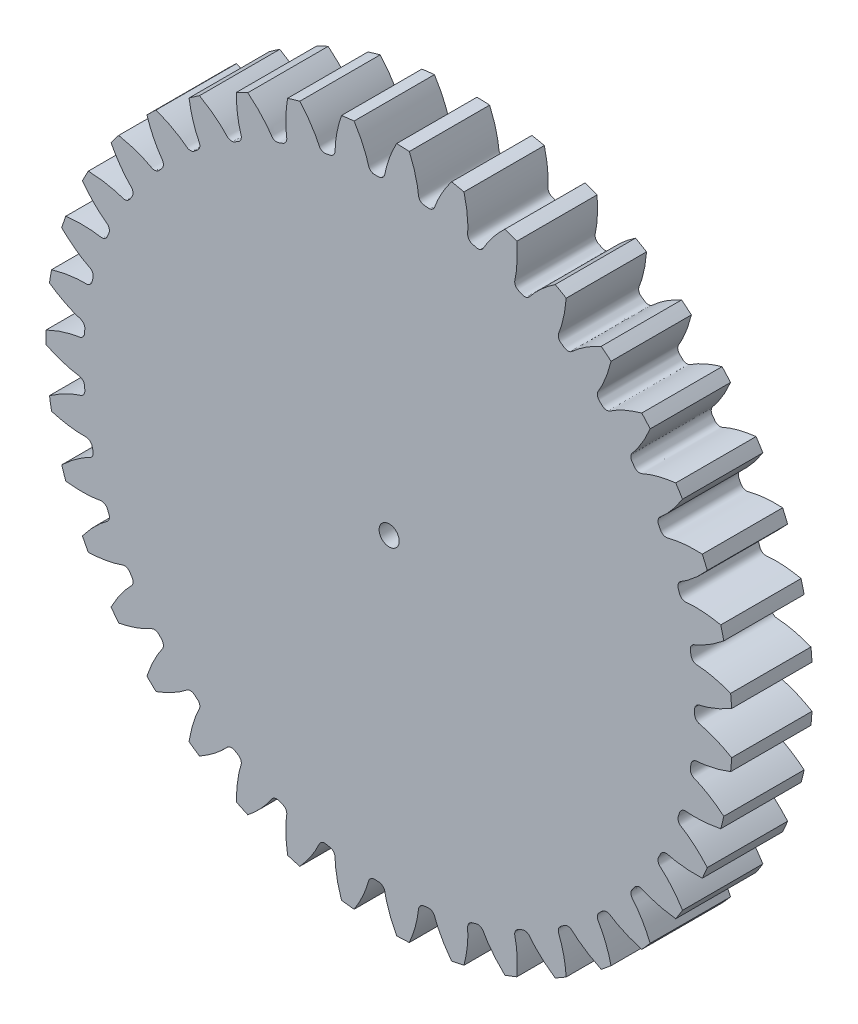
from build123d import *

# Parameters (mm, degrees)
SKETCHREVOLVESPURGEAR2_W       = 19.05
SKETCHREVOLVESPURGEAR2_H       = 51.24999923
TOOTHEXTRUDECUTSPURGEAR2_DEPTH = 9.525
PATTERNSPURGEAR2_COUNT         = 39
BOREREVOLVESKETCH_W            = 19.05
BOREREVOLVESKETCH_H            = 1.5
SCALE_1_SCALE                  = 0.2
CUT_EXTRUDE_START              = -1.41
CUT_EXTRUDE_2_DEPTH            = 1.41


with BuildPart() as part:
    # SketchRevolveSpurGear2 → SpurGear2 (revolve)
    with BuildSketch(Plane(origin=(0, 0, 0), x_dir=(0, 0, -1), z_dir=(1, 0, 0)), mode=Mode.PRIVATE) as spurgear2_sk:
        with Locations((0, 25.624999615)):
            Rectangle(SKETCHREVOLVESPURGEAR2_W, SKETCHREVOLVESPURGEAR2_H)
    revolve(spurgear2_sk.sketch.rotate(Axis((0, 0, 0), (0, 0, -1)), 90), axis=Axis((0, 0, 0), (0, 0, -1)))

    # SketchToothSpurGear2 → ToothExtrudeCutSpurGear2 (cut, symmetric)
    with BuildSketch(Plane.XY):
        with BuildLine():
            ThreePointArc((51.272187141, 3.248595306), (51.374999228, 0), (51.272187141, -3.248595306))
            add(Edge.make_bspline(
                [(51.272187141, -3.248595306), (50.943252812, -3.054548801), (50.506333986, -2.811001816), (49.959968001, -2.531658617), (49.653939578, -2.381814814), (49.357790543, -2.243106829), (49.07181105, -2.115146376), (48.796280611, -1.997538153), (48.531468078, -1.889880716), (48.277631617, -1.791765884), (48.035018044, -1.702781593), (47.803864592, -1.62250326), (47.584392263, -1.550524582), (47.376828065, -1.486353351), (47.181328843, -1.429767035), (46.833827321, -1.334573166), (46.496477285, -1.265922447), (46.178793808, -1.164548685), (46.04245566, -1.088659483), (45.919952224, -0.992633504), (45.815117449, -0.877381893), (45.730590698, -0.746517551), (45.669115125, -0.603495392), (45.630877263, -0.452267385), (45.619908701, -0.249546781), (45.628343747, 0), (45.619908701, 0.249546781), (45.630877263, 0.452267385), (45.669115125, 0.603495392), (45.730590698, 0.746517551), (45.815117449, 0.877381893), (45.919952224, 0.992633504), (46.04245566, 1.088659483), (46.178793808, 1.164548685), (46.496477285, 1.265922447), (46.833827321, 1.334573166), (47.181328843, 1.429767035), (47.376828065, 1.486353351), (47.584392263, 1.550524582), (47.803864592, 1.62250326), (48.035018044, 1.702781593), (48.277631617, 1.791765884), (48.531468078, 1.889880716), (48.796280611, 1.997538153), (49.07181105, 2.115146376), (49.357790543, 2.243106829), (49.653939578, 2.381814814), (49.959968001, 2.531658617), (50.506333986, 2.811001816), (50.943252812, 3.054548801), (51.272187141, 3.248595306)],
                knots=[0, 0, 0, 0, 0.082919838, 0.108574348, 0.133235789, 0.15690416, 0.179579463, 0.201261696, 0.22195086, 0.241646954, 0.26034998, 0.278059936, 0.294776824, 0.310500642, 0.325231391, 0.338969071, 0.38872205, 0.399944921, 0.411167793, 0.422390664, 0.433613536, 0.444836407, 0.456059279, 0.46728215, 0.478505022, 0.5, 0.521494978, 0.53271785, 0.543940721, 0.555163593, 0.566386464, 0.577609336, 0.588832207, 0.600055079, 0.61127795, 0.661030929, 0.674768609, 0.689499358, 0.705223176, 0.721940064, 0.73965002, 0.758353046, 0.77804914, 0.798738304, 0.820420537, 0.84309584, 0.866764211, 0.891425652, 0.917080162, 1, 1, 1, 1], degree=3))
        make_face()
    toothextrudecutspurgear2 = extrude(amount=TOOTHEXTRUDECUTSPURGEAR2_DEPTH, both=True, mode=Mode.SUBTRACT)

    # PatternSpurGear2: ToothExtrudeCutSpurGear2 ×39 about axis
    patternspurgear2_axis = Axis((0, 0, 55), (0, 0, -1))
    for i in range(1, PATTERNSPURGEAR2_COUNT):
        add(toothextrudecutspurgear2.rotate(patternspurgear2_axis, i * 360 / PATTERNSPURGEAR2_COUNT), mode=Mode.SUBTRACT)

    # BoreRevolveSketch → BoreRevolveCut (revolve, cut)
    with BuildSketch(Plane(origin=(0, 0, 0), x_dir=(0, 0, -1), z_dir=(1, 0, 0)), mode=Mode.PRIVATE) as borerevolvecut_sk:
        with Locations((0, 0.75)):
            Rectangle(BOREREVOLVESKETCH_W, BOREREVOLVESKETCH_H)
    revolve(borerevolvecut_sk.sketch.rotate(Axis((0, 0, 0), (0, 0, -1)), 90), axis=Axis((0, 0, 0), (0, 0, -1)), mode=Mode.SUBTRACT)


with BuildPart() as part_1:
    # 缩放比例1: scaled about (0, 0, 0)
    add(part.part.scale(SCALE_1_SCALE))

    # 草图5 → 切除-拉伸2 (cut)
    with BuildSketch(Plane.XY.offset(1.905).offset(CUT_EXTRUDE_START)):
        with BuildLine():
            ThreePointArc((0.22311641, -10.24757122), (0.41272588, -10.241687077), (0.602193982, -10.232294916))
            add(Edge.make_bspline(
                [(0.602193982, -10.232294916), (0.628681014, -10.170701823), (0.66268822, -10.08662064), (0.701761743, -9.980172262), (0.724134467, -9.915800501), (0.744534432, -9.853658666), (0.763045724, -9.793795004), (0.779753565, -9.736255481), (0.794744138, -9.681083796), (0.80810471, -9.628321368), (0.819923043, -9.578007264), (0.830289151, -9.530178351), (0.839289033, -9.484868711), (0.847025883, -9.442111549), (0.853547665, -9.401932641), (0.864070289, -9.330644202), (0.869567714, -9.262011141), (0.882036138, -9.196493848), (0.893816565, -9.167595544), (0.909928502, -9.140958564), (0.930283474, -9.117366072), (0.954227798, -9.09742919), (0.981141659, -9.081775838), (1.010244923, -9.07053832), (1.050229009, -9.063473549), (1.099977816, -9.05913235), (1.149319931, -9.051441733), (1.189832862, -9.048732397), (1.220779752, -9.052678505), (1.250657637, -9.061436091), (1.278677391, -9.075063392), (1.304086937, -9.093099065), (1.326105337, -9.115106184), (1.344459264, -9.140345515), (1.372244692, -9.200975105), (1.394007339, -9.266298194), (1.421284634, -9.332996892), (1.437232347, -9.37044751), (1.454976837, -9.410110677), (1.474558505, -9.451949888), (1.496069602, -9.495908208), (1.519585468, -9.541931963), (1.545184682, -9.589963817), (1.572943105, -9.639944834), (1.602935555, -9.691813915), (1.635235254, -9.745508006), (1.669913948, -9.800962081), (1.707041733, -9.858109172), (1.770454615, -9.952113447), (1.823595576, -10.025612927), (1.864053136, -10.079077475)],
                knots=[0.010133208, 0.010133208, 0.010133208, 0.010133208, 0.082919838, 0.108574348, 0.133235789, 0.15690416, 0.179579463, 0.201261696, 0.22195086, 0.241646954, 0.26034998, 0.278059936, 0.294776824, 0.310500642, 0.325231391, 0.338969071, 0.38872205, 0.399944921, 0.411167793, 0.422390664, 0.433613536, 0.444836407, 0.456059279, 0.46728215, 0.478505022, 0.5, 0.521494978, 0.53271785, 0.543940721, 0.555163593, 0.566386464, 0.577609336, 0.588832207, 0.600055079, 0.61127795, 0.661030929, 0.674768609, 0.689499358, 0.705223176, 0.721940064, 0.73965002, 0.758353046, 0.77804914, 0.798738304, 0.820420537, 0.84309584, 0.866764211, 0.891425652, 0.917080162, 0.989866792, 0.989866792, 0.989866792, 0.989866792], degree=3))
            ThreePointArc((1.864053136, -10.079077475), (2.05026333, -10.042854033), (2.235771262, -10.003190676))
            add(Edge.make_bspline(
                [(2.235771262, -10.003190676), (2.252035067, -9.938146379), (2.272114318, -9.849698886), (2.293606328, -9.738361152), (2.305363375, -9.671234151), (2.315530915, -9.606624652), (2.324199683, -9.544566789), (2.331461173, -9.485092261), (2.337407462, -9.428230379), (2.34213133, -9.374008023), (2.345725668, -9.32244968), (2.348285241, -9.273577298), (2.349900399, -9.227410723), (2.350678328, -9.183966178), (2.350670504, -9.143261409), (2.349621393, -9.071208188), (2.344038111, -9.002582058), (2.345835359, -8.935913122), (2.352827619, -8.905499329), (2.364458038, -8.876622754), (2.380764917, -8.850070612), (2.401201068, -8.826550968), (2.425255427, -8.806783035), (2.452179187, -8.791022549), (2.49051222, -8.777635366), (2.538920416, -8.765370115), (2.586389901, -8.749864057), (2.625943593, -8.740691075), (2.657122729, -8.739621852), (2.688018519, -8.74347328), (2.717861397, -8.752429426), (2.745835022, -8.766155564), (2.771098479, -8.784345697), (2.793263401, -8.806314009), (2.830414686, -8.861701365), (2.862374072, -8.922687563), (2.899997357, -8.984146945), (2.921746053, -9.018554394), (2.945623176, -9.054857517), (2.971662748, -9.093013801), (2.999946692, -9.132952249), (3.030540763, -9.174607799), (3.063513325, -9.217911251), (3.098929803, -9.262792262), (3.136854245, -9.309178525), (3.177348809, -9.356996055), (3.220473882, -9.40616916), (3.26628791, -9.456620496), (3.343958958, -9.5392353), (3.408201904, -9.603258571), (3.456711865, -9.649540918)],
                knots=[0.010133208, 0.010133208, 0.010133208, 0.010133208, 0.082919838, 0.108574348, 0.133235789, 0.15690416, 0.179579463, 0.201261696, 0.22195086, 0.241646954, 0.26034998, 0.278059936, 0.294776824, 0.310500642, 0.325231391, 0.338969071, 0.38872205, 0.399944921, 0.411167793, 0.422390664, 0.433613536, 0.444836407, 0.456059279, 0.46728215, 0.478505022, 0.5, 0.521494978, 0.53271785, 0.543940721, 0.555163593, 0.566386464, 0.577609336, 0.588832207, 0.600055079, 0.61127795, 0.661030929, 0.674768609, 0.689499358, 0.705223176, 0.721940064, 0.73965002, 0.758353046, 0.77804914, 0.798738304, 0.820420537, 0.84309584, 0.866764211, 0.891425652, 0.917080162, 0.989866792, 0.989866792, 0.989866792, 0.989866792], degree=3))
            ThreePointArc((3.456711865, -9.649540918), (3.634700038, -9.583916344), (3.81144324, -9.515009053))
            add(Edge.make_bspline(
                [(3.81144324, -9.515009053), (3.817062595, -9.448198164), (3.822693848, -9.357675104), (3.826047714, -9.244331604), (3.826884583, -9.176187917), (3.826556363, -9.110784106), (3.825158092, -9.048139308), (3.822785162, -8.988270135), (3.819533161, -8.931190746), (3.815497978, -8.876912795), (3.81077523, -8.825445546), (3.805461976, -8.776795464), (3.799650579, -8.730967645), (3.793449439, -8.687960906), (3.786912213, -8.647784508), (3.774318537, -8.576832647), (3.757799152, -8.509990829), (3.748878677, -8.443896939), (3.750901673, -8.41275536), (3.757749354, -8.382387079), (3.769585799, -8.353562972), (3.785984491, -8.327069712), (3.806556353, -8.303699179), (3.830603298, -8.283823912), (3.866292473, -8.264461038), (3.912106311, -8.244589398), (3.956473732, -8.221669499), (3.994043764, -8.206270446), (4.024647623, -8.200213585), (4.055761133, -8.199059104), (4.086654221, -8.203112136), (4.116467422, -8.212173239), (4.144321627, -8.226075271), (4.169723483, -8.244203595), (4.215278426, -8.292914215), (4.25660682, -8.347984012), (4.303601672, -8.402612311), (4.330588071, -8.433085456), (4.359979422, -8.465088303), (4.391802486, -8.498573433), (4.426126738, -8.533457625), (4.463006645, -8.569666112), (4.502498583, -8.607119624), (4.544655847, -8.645738236), (4.589530057, -8.6854403), (4.637170699, -8.726142821), (4.687625234, -8.7677614), (4.740938946, -8.810210317), (4.83085652, -8.879295968), (4.904537592, -8.932184862), (4.959843573, -8.97008632)],
                knots=[0.010133208, 0.010133208, 0.010133208, 0.010133208, 0.082919838, 0.108574348, 0.133235789, 0.15690416, 0.179579463, 0.201261696, 0.22195086, 0.241646954, 0.26034998, 0.278059936, 0.294776824, 0.310500642, 0.325231391, 0.338969071, 0.38872205, 0.399944921, 0.411167793, 0.422390664, 0.433613536, 0.444836407, 0.456059279, 0.46728215, 0.478505022, 0.5, 0.521494978, 0.53271785, 0.543940721, 0.555163593, 0.566386464, 0.577609336, 0.588832207, 0.600055079, 0.61127795, 0.661030929, 0.674768609, 0.689499358, 0.705223176, 0.721940064, 0.73965002, 0.758353046, 0.77804914, 0.798738304, 0.820420537, 0.84309584, 0.866764211, 0.891425652, 0.917080162, 0.989866792, 0.989866792, 0.989866792, 0.989866792], degree=3))
            ThreePointArc((4.959843573, -8.97008632), (5.124999923, -8.876760255), (5.288400841, -8.780393692))
            add(Edge.make_bspline(
                [(5.288400841, -8.780393692), (5.283230206, -8.713546579), (5.274267616, -8.623292453), (5.259396475, -8.510878723), (5.24929149, -8.443483236), (5.238476011, -8.378979037), (5.227046915, -8.317369771), (5.215101023, -8.258656533), (5.202734957, -8.202837965), (5.190045233, -8.149910187), (5.177127716, -8.099867008), (5.164079245, -8.052699238), (5.150991805, -8.008397091), (5.137972202, -7.966942011), (5.125074884, -7.928334532), (5.101262814, -7.860321646), (5.074235169, -7.796995308), (5.054828006, -7.733188261), (5.051829345, -7.702125445), (5.053716934, -7.671051981), (5.06077639, -7.64070244), (5.072712905, -7.611921725), (5.089269469, -7.585553875), (5.109816795, -7.562078586), (5.141937781, -7.537241511), (5.183970707, -7.510278146), (5.224086971, -7.480538019), (5.258700299, -7.459311723), (5.287936258, -7.448424092), (5.318461664, -7.442293604), (5.349604847, -7.44133855), (5.380485478, -7.445499941), (5.410209021, -7.454753816), (5.438189918, -7.468572639), (5.490968668, -7.509344942), (5.540595688, -7.557072059), (5.595744964, -7.603454432), (5.627270132, -7.629204035), (5.661414491, -7.656077749), (5.698196848, -7.684024477), (5.737672427, -7.712950931), (5.779882998, -7.742774574), (5.824871492, -7.773408121), (5.872677692, -7.804764131), (5.923339451, -7.836753735), (5.976892303, -7.869287072), (6.033369555, -7.902273224), (6.092802153, -7.935620319), (6.192637436, -7.989387536), (6.273848333, -8.029772257), (6.334517937, -8.058311197)],
                knots=[0.010133208, 0.010133208, 0.010133208, 0.010133208, 0.082919838, 0.108574348, 0.133235789, 0.15690416, 0.179579463, 0.201261696, 0.22195086, 0.241646954, 0.26034998, 0.278059936, 0.294776824, 0.310500642, 0.325231391, 0.338969071, 0.38872205, 0.399944921, 0.411167793, 0.422390664, 0.433613536, 0.444836407, 0.456059279, 0.46728215, 0.478505022, 0.5, 0.521494978, 0.53271785, 0.543940721, 0.555163593, 0.566386464, 0.577609336, 0.588832207, 0.600055079, 0.61127795, 0.661030929, 0.674768609, 0.689499358, 0.705223176, 0.721940064, 0.73965002, 0.758353046, 0.77804914, 0.798738304, 0.820420537, 0.84309584, 0.866764211, 0.891425652, 0.917080162, 0.989866792, 0.989866792, 0.989866792, 0.989866792], degree=3))
            ThreePointArc((6.334517937, -8.058311197), (6.482565002, -7.939700739), (6.628391637, -7.818370748))
            add(Edge.make_bspline(
                [(6.628391637, -7.818370748), (6.61256493, -7.753218715), (6.589240623, -7.665571056), (6.556529629, -7.556998554), (6.535744504, -7.492096774), (6.514721882, -7.430162813), (6.493557968, -7.371184726), (6.472348507, -7.315148065), (6.45118865, -7.26203599), (6.430173042, -7.211829188), (6.409395314, -7.16450617), (6.388949575, -7.120042332), (6.368925049, -7.078413259), (6.349424184, -7.039583502), (6.330500807, -7.003544855), (6.296087064, -6.940232443), (6.25925116, -6.882061704), (6.229859945, -6.822194069), (6.221917289, -6.792014528), (6.218795901, -6.761040666), (6.220895529, -6.729951727), (6.228060718, -6.699628963), (6.240173179, -6.67094671), (6.256688721, -6.644479398), (6.284409603, -6.614811387), (6.321572985, -6.581454636), (6.356399102, -6.545664534), (6.387159259, -6.519160745), (6.414270121, -6.503724328), (6.443416832, -6.492776608), (6.474003517, -6.486838205), (6.505151786, -6.485992105), (6.535974843, -6.490358153), (6.56581009, -6.499509575), (6.624445707, -6.53128758), (6.681086037, -6.57043591), (6.742961401, -6.607371077), (6.778208853, -6.627730237), (6.816221898, -6.648778803), (6.857010903, -6.670463323), (6.900615414, -6.692682859), (6.947063418, -6.715349242), (6.996383289, -6.738369431), (7.048600269, -6.761650734), (7.103737466, -6.785099364), (7.161815536, -6.808620921), (7.222852773, -6.832120323), (7.286864985, -6.855501923), (7.394032296, -6.892558162), (7.480669697, -6.919392768), (7.545131614, -6.937830048)],
                knots=[0.010133208, 0.010133208, 0.010133208, 0.010133208, 0.082919838, 0.108574348, 0.133235789, 0.15690416, 0.179579463, 0.201261696, 0.22195086, 0.241646954, 0.26034998, 0.278059936, 0.294776824, 0.310500642, 0.325231391, 0.338969071, 0.38872205, 0.399944921, 0.411167793, 0.422390664, 0.433613536, 0.444836407, 0.456059279, 0.46728215, 0.478505022, 0.5, 0.521494978, 0.53271785, 0.543940721, 0.555163593, 0.566386464, 0.577609336, 0.588832207, 0.600055079, 0.61127795, 0.661030929, 0.674768609, 0.689499358, 0.705223176, 0.721940064, 0.73965002, 0.758353046, 0.77804914, 0.798738304, 0.820420537, 0.84309584, 0.866764211, 0.891425652, 0.917080162, 0.989866792, 0.989866792, 0.989866792, 0.989866792], degree=3))
            ThreePointArc((7.545131614, -6.937830048), (7.672235054, -6.797007145), (7.796710572, -6.653856107))
            add(Edge.make_bspline(
                [(7.796710572, -6.653856107), (7.770637695, -6.592086559), (7.73355576, -6.509315396), (7.68385211, -6.407396092), (7.652925169, -6.346668941), (7.622239878, -6.288909274), (7.591889282, -6.234089869), (7.561965565, -6.182181104), (7.532559946, -6.133151096), (7.503762747, -6.0869656), (7.475662939, -6.043588385), (7.448349466, -6.002980069), (7.42190648, -5.965102241), (7.396429414, -5.929903479), (7.371970085, -5.897367046), (7.327845966, -5.840394866), (7.282155834, -5.788886316), (7.243541784, -5.734508634), (7.230860845, -5.705994002), (7.22281132, -5.675921949), (7.219896743, -5.6448988), (7.222105031, -5.613819331), (7.229459682, -5.58356553), (7.241515697, -5.554791683), (7.264118516, -5.521061123), (7.295449843, -5.482174907), (7.324083835, -5.441261776), (7.35019415, -5.410166928), (7.374477757, -5.39058152), (7.401490889, -5.375100109), (7.430728897, -5.364332157), (7.46133808, -5.35850048), (7.49246235, -5.357865624), (7.523379229, -5.362112627), (7.586353081, -5.384073301), (7.648539768, -5.413628922), (7.715538679, -5.440160282), (7.753595525, -5.454601707), (7.794492739, -5.469279979), (7.838231979, -5.484140673), (7.884836087, -5.499077816), (7.934318545, -5.513999892), (7.986692435, -5.528810512), (8.041967802, -5.543414136), (8.100152411, -5.557714483), (8.161251509, -5.571615065), (8.225267899, -5.585019095), (8.292201842, -5.597829627), (8.403925603, -5.617215153), (8.493745646, -5.629804641), (8.560330346, -5.637662744)],
                knots=[0.010133208, 0.010133208, 0.010133208, 0.010133208, 0.082919838, 0.108574348, 0.133235789, 0.15690416, 0.179579463, 0.201261696, 0.22195086, 0.241646954, 0.26034998, 0.278059936, 0.294776824, 0.310500642, 0.325231391, 0.338969071, 0.38872205, 0.399944921, 0.411167793, 0.422390664, 0.433613536, 0.444836407, 0.456059279, 0.46728215, 0.478505022, 0.5, 0.521494978, 0.53271785, 0.543940721, 0.555163593, 0.566386464, 0.577609336, 0.588832207, 0.600055079, 0.61127795, 0.661030929, 0.674768609, 0.689499358, 0.705223176, 0.721940064, 0.73965002, 0.758353046, 0.77804914, 0.798738304, 0.820420537, 0.84309584, 0.866764211, 0.891425652, 0.917080162, 0.989866792, 0.989866792, 0.989866792, 0.989866792], degree=3))
            ThreePointArc((8.560330346, -5.637662744), (8.663198247, -5.478274636), (8.763098799, -5.317010089))
            add(Edge.make_bspline(
                [(8.763098799, -5.317010089), (8.727455027, -5.260222824), (8.677575864, -5.184471886), (8.612166857, -5.091845436), (8.571899092, -5.036865717), (8.532345866, -4.984776289), (8.49359465, -4.935535359), (8.455731686, -4.889098901), (8.418841896, -4.845420811), (8.383008939, -4.8044528), (8.348314821, -4.766144835), (8.314841018, -4.730443775), (8.282664431, -4.697298209), (8.251871008, -4.66664207), (8.22250921, -4.638450528), (8.169817506, -4.589294129), (8.116456498, -4.545781814), (8.069619695, -4.498302438), (8.052528902, -4.472191228), (8.039759721, -4.443799835), (8.031906423, -4.413645959), (8.029100617, -4.382614726), (8.031506976, -4.351572935), (8.038791219, -4.321237781), (8.055690575, -4.284318276), (8.080378382, -4.240909728), (8.102078644, -4.195933196), (8.122862872, -4.161052629), (8.143690293, -4.137825483), (8.167870219, -4.118211341), (8.195002302, -4.102892725), (8.224279637, -4.092226508), (8.254899018, -4.086607189), (8.286096799, -4.085839778), (8.351777896, -4.097414351), (8.417900336, -4.116611788), (8.488287559, -4.132052193), (8.528168146, -4.140201858), (8.570890312, -4.148129676), (8.616446963, -4.15578166), (8.664843646, -4.163049547), (8.716078989, -4.169840841), (8.770150441, -4.176058304), (8.827052593, -4.181606023), (8.886777663, -4.186387717), (8.949315354, -4.190307306), (9.014652906, -4.193268805), (9.082775026, -4.195176485), (9.196161651, -4.196389222), (9.286838044, -4.194407531), (9.353821018, -4.191482937)],
                knots=[0.010133208, 0.010133208, 0.010133208, 0.010133208, 0.082919838, 0.108574348, 0.133235789, 0.15690416, 0.179579463, 0.201261696, 0.22195086, 0.241646954, 0.26034998, 0.278059936, 0.294776824, 0.310500642, 0.325231391, 0.338969071, 0.38872205, 0.399944921, 0.411167793, 0.422390664, 0.433613536, 0.444836407, 0.456059279, 0.46728215, 0.478505022, 0.5, 0.521494978, 0.53271785, 0.543940721, 0.555163593, 0.566386464, 0.577609336, 0.588832207, 0.600055079, 0.61127795, 0.661030929, 0.674768609, 0.689499358, 0.705223176, 0.721940064, 0.73965002, 0.758353046, 0.77804914, 0.798738304, 0.820420537, 0.84309584, 0.866764211, 0.891425652, 0.917080162, 0.989866792, 0.989866792, 0.989866792, 0.989866792], degree=3))
            ThreePointArc((9.353821018, -4.191482937), (9.429789156, -4.017657691), (9.50252737, -3.842456302))
            add(Edge.make_bspline(
                [(9.50252737, -3.842456302), (9.458235857, -3.79212208), (9.396851311, -3.725353278), (9.317431006, -3.644418659), (9.268865332, -3.596610316), (9.221468577, -3.551540216), (9.175320379, -3.509153075), (9.130498798, -3.469391604), (9.087080264, -3.432196673), (9.045139602, -3.397507197), (9.004749735, -3.365260638), (8.965982556, -3.335391473), (8.928905724, -3.307836621), (8.893593478, -3.282517083), (8.860089666, -3.259400577), (8.800195064, -3.219333084), (8.740545201, -3.184943951), (8.686698695, -3.145592571), (8.665640691, -3.122561051), (8.648482567, -3.09658564), (8.635893946, -3.068082006), (8.628146715, -3.037902703), (8.625542459, -3.006876887), (8.627866271, -2.975766091), (8.638624481, -2.936613836), (8.656029366, -2.889807215), (8.670233872, -2.84193215), (8.685153713, -2.804169252), (8.701985529, -2.777901939), (8.722706001, -2.754663062), (8.747029451, -2.735190526), (8.774216671, -2.719966019), (8.803538137, -2.709507774), (8.834208814, -2.703745825), (8.90089605, -2.704634521), (8.969241707, -2.712976571), (9.041194249, -2.716926123), (9.081865691, -2.718572955), (9.125306328, -2.719544993), (9.171500497, -2.719790085), (9.220436307, -2.719200481), (9.272097566, -2.717685103), (9.326466158, -2.71514838), (9.383521358, -2.711496511), (9.443240043, -2.706635708), (9.505596633, -2.700472788), (9.570563139, -2.692915056), (9.638109108, -2.683870476), (9.750221943, -2.666879014), (9.839406215, -2.650377469), (9.905052639, -2.636745924)],
                knots=[0.010133208, 0.010133208, 0.010133208, 0.010133208, 0.082919838, 0.108574348, 0.133235789, 0.15690416, 0.179579463, 0.201261696, 0.22195086, 0.241646954, 0.26034998, 0.278059936, 0.294776824, 0.310500642, 0.325231391, 0.338969071, 0.38872205, 0.399944921, 0.411167793, 0.422390664, 0.433613536, 0.444836407, 0.456059279, 0.46728215, 0.478505022, 0.5, 0.521494978, 0.53271785, 0.543940721, 0.555163593, 0.566386464, 0.577609336, 0.588832207, 0.600055079, 0.61127795, 0.661030929, 0.674768609, 0.689499358, 0.705223176, 0.721940064, 0.73965002, 0.758353046, 0.77804914, 0.798738304, 0.820420537, 0.84309584, 0.866764211, 0.891425652, 0.917080162, 0.989866792, 0.989866792, 0.989866792, 0.989866792], degree=3))
            ThreePointArc((9.905052639, -2.636745924), (9.952153479, -2.452985522), (9.995845473, -2.268384915))
            add(Edge.make_bspline(
                [(9.995845473, -2.268384915), (9.944053347, -2.225807367), (9.872753246, -2.169749977), (9.781378587, -2.102603352), (9.725772827, -2.063204597), (9.671760096, -2.026321117), (9.619410129, -1.99188557), (9.568790788, -1.959828887), (9.519968025, -1.930080443), (9.473005901, -1.902567942), (9.42796636, -1.877217958), (9.384909855, -1.853954284), (9.343893049, -1.832703801), (9.304976548, -1.813376628), (9.268198453, -1.795933864), (9.202652193, -1.765993004), (9.138258375, -1.741617712), (9.078796762, -1.71141351), (9.054316938, -1.692058183), (9.033214258, -1.669171503), (9.016216351, -1.64305634), (9.003728344, -1.614510595), (8.996180922, -1.584304308), (8.993484119, -1.553223622), (8.997822549, -1.512852641), (9.007493736, -1.463860213), (9.013834597, -1.414326554), (9.022503635, -1.374659366), (9.03490391, -1.346032194), (9.051628279, -1.319770457), (9.072513133, -1.296648329), (9.096906103, -1.277259838), (9.124170243, -1.262233531), (9.153519461, -1.251626276), (9.219485671, -1.241806079), (9.28828443, -1.239076687), (9.359938757, -1.231433093), (9.400347686, -1.226534442), (9.443381703, -1.220525523), (9.489016985, -1.213357376), (9.53722451, -1.20492555), (9.587973686, -1.195142748), (9.6412313, -1.18391754), (9.696961849, -1.171160663), (9.755127465, -1.156783256), (9.815687952, -1.140697443), (9.878600813, -1.122816222), (9.943821228, -1.103053631), (10.051756608, -1.068298041), (10.137138933, -1.037704023), (10.1997486, -1.013718576)],
                knots=[0.010133208, 0.010133208, 0.010133208, 0.010133208, 0.082919838, 0.108574348, 0.133235789, 0.15690416, 0.179579463, 0.201261696, 0.22195086, 0.241646954, 0.26034998, 0.278059936, 0.294776824, 0.310500642, 0.325231391, 0.338969071, 0.38872205, 0.399944921, 0.411167793, 0.422390664, 0.433613536, 0.444836407, 0.456059279, 0.46728215, 0.478505022, 0.5, 0.521494978, 0.53271785, 0.543940721, 0.555163593, 0.566386464, 0.577609336, 0.588832207, 0.600055079, 0.61127795, 0.661030929, 0.674768609, 0.689499358, 0.705223176, 0.721940064, 0.73965002, 0.758353046, 0.77804914, 0.798738304, 0.820420537, 0.84309584, 0.866764211, 0.891425652, 0.917080162, 0.989866792, 0.989866792, 0.989866792, 0.989866792], degree=3))
            ThreePointArc((10.1997486, -1.013718576), (10.216762255, -0.824782317), (10.230276429, -0.635563551))
            add(Edge.make_bspline(
                [(10.230276429, -0.635563551), (10.172325078, -0.601845412), (10.092956057, -0.557951291), (9.9919936, -0.506331723), (9.930787916, -0.476362963), (9.871558109, -0.448621366), (9.81436221, -0.423029275), (9.759256122, -0.399507631), (9.706293616, -0.377976143), (9.655526323, -0.358353177), (9.607003609, -0.340556319), (9.560772918, -0.324500652), (9.516878453, -0.310104916), (9.475365613, -0.29727067), (9.436265769, -0.285953407), (9.366765464, -0.266914633), (9.299295457, -0.253184489), (9.235758762, -0.232909737), (9.208491132, -0.217731897), (9.183990445, -0.198526701), (9.16302349, -0.175476379), (9.14611814, -0.14930351), (9.133823025, -0.120699078), (9.126175453, -0.090453477), (9.12398174, -0.049909356), (9.125668749, 0), (9.12398174, 0.049909356), (9.126175453, 0.090453477), (9.133823025, 0.120699078), (9.14611814, 0.14930351), (9.16302349, 0.175476379), (9.183990445, 0.198526701), (9.208491132, 0.217731897), (9.235758762, 0.232909737), (9.299295457, 0.253184489), (9.366765464, 0.266914633), (9.436265769, 0.285953407), (9.475365613, 0.29727067), (9.516878453, 0.310104916), (9.560772918, 0.324500652), (9.607003609, 0.340556319), (9.655526323, 0.358353177), (9.706293616, 0.377976143), (9.759256122, 0.399507631), (9.81436221, 0.423029275), (9.871558109, 0.448621366), (9.930787916, 0.476362963), (9.9919936, 0.506331723), (10.092956057, 0.557951291), (10.172325078, 0.601845412), (10.230276429, 0.635563551)],
                knots=[0.010133208, 0.010133208, 0.010133208, 0.010133208, 0.082919838, 0.108574348, 0.133235789, 0.15690416, 0.179579463, 0.201261696, 0.22195086, 0.241646954, 0.26034998, 0.278059936, 0.294776824, 0.310500642, 0.325231391, 0.338969071, 0.38872205, 0.399944921, 0.411167793, 0.422390664, 0.433613536, 0.444836407, 0.456059279, 0.46728215, 0.478505022, 0.5, 0.521494978, 0.53271785, 0.543940721, 0.555163593, 0.566386464, 0.577609336, 0.588832207, 0.600055079, 0.61127795, 0.661030929, 0.674768609, 0.689499358, 0.705223176, 0.721940064, 0.73965002, 0.758353046, 0.77804914, 0.798738304, 0.820420537, 0.84309584, 0.866764211, 0.891425652, 0.917080162, 0.989866792, 0.989866792, 0.989866792, 0.989866792], degree=3))
            ThreePointArc((10.230276429, 0.635563551), (10.216762255, 0.824782317), (10.1997486, 1.013718576))
            add(Edge.make_bspline(
                [(10.1997486, 1.013718576), (10.137138933, 1.037704023), (10.051756608, 1.068298041), (9.943821228, 1.103053631), (9.878600813, 1.122816222), (9.815687952, 1.140697443), (9.755127465, 1.156783256), (9.696961849, 1.171160663), (9.6412313, 1.18391754), (9.587973686, 1.195142748), (9.53722451, 1.20492555), (9.489016985, 1.213357376), (9.443381703, 1.220525523), (9.400347686, 1.226534442), (9.359938757, 1.231433093), (9.28828443, 1.239076687), (9.219485671, 1.241806079), (9.153519461, 1.251626276), (9.124170243, 1.262233531), (9.096906103, 1.277259838), (9.072513133, 1.296648329), (9.051628279, 1.319770457), (9.03490391, 1.346032194), (9.022503635, 1.374659366), (9.013834597, 1.414326554), (9.007493736, 1.463860213), (8.997822549, 1.512852641), (8.993484119, 1.553223622), (8.996180922, 1.584304308), (9.003728344, 1.614510595), (9.016216351, 1.64305634), (9.033214258, 1.669171503), (9.054316938, 1.692058183), (9.078796762, 1.71141351), (9.138258375, 1.741617712), (9.202652193, 1.765993004), (9.268198453, 1.795933864), (9.304976548, 1.813376628), (9.343893049, 1.832703801), (9.384909855, 1.853954284), (9.42796636, 1.877217958), (9.473005901, 1.902567942), (9.519968025, 1.930080443), (9.568790788, 1.959828887), (9.619410129, 1.99188557), (9.671760096, 2.026321117), (9.725772827, 2.063204597), (9.781378587, 2.102603352), (9.872753246, 2.169749977), (9.944053347, 2.225807367), (9.995845473, 2.268384915)],
                knots=[0.010133208, 0.010133208, 0.010133208, 0.010133208, 0.082919838, 0.108574348, 0.133235789, 0.15690416, 0.179579463, 0.201261696, 0.22195086, 0.241646954, 0.26034998, 0.278059936, 0.294776824, 0.310500642, 0.325231391, 0.338969071, 0.38872205, 0.399944921, 0.411167793, 0.422390664, 0.433613536, 0.444836407, 0.456059279, 0.46728215, 0.478505022, 0.5, 0.521494978, 0.53271785, 0.543940721, 0.555163593, 0.566386464, 0.577609336, 0.588832207, 0.600055079, 0.61127795, 0.661030929, 0.674768609, 0.689499358, 0.705223176, 0.721940064, 0.73965002, 0.758353046, 0.77804914, 0.798738304, 0.820420537, 0.84309584, 0.866764211, 0.891425652, 0.917080162, 0.989866792, 0.989866792, 0.989866792, 0.989866792], degree=3))
            ThreePointArc((9.995845473, 2.268384915), (9.952153479, 2.452985522), (9.905052639, 2.636745924))
            add(Edge.make_bspline(
                [(9.905052639, 2.636745924), (9.839406215, 2.650377469), (9.750221943, 2.666879014), (9.638109108, 2.683870476), (9.570563139, 2.692915056), (9.505596633, 2.700472788), (9.443240043, 2.706635708), (9.383521358, 2.711496511), (9.326466158, 2.71514838), (9.272097566, 2.717685103), (9.220436307, 2.719200481), (9.171500497, 2.719790085), (9.125306328, 2.719544993), (9.081865691, 2.718572955), (9.041194249, 2.716926123), (8.969241707, 2.712976571), (8.90089605, 2.704634521), (8.834208814, 2.703745825), (8.803538137, 2.709507774), (8.774216671, 2.719966019), (8.747029451, 2.735190526), (8.722706001, 2.754663062), (8.701985529, 2.777901939), (8.685153713, 2.804169252), (8.670233872, 2.84193215), (8.656029366, 2.889807215), (8.638624481, 2.936613836), (8.627866271, 2.975766091), (8.625542459, 3.006876887), (8.628146715, 3.037902703), (8.635893946, 3.068082006), (8.648482567, 3.09658564), (8.665640691, 3.122561051), (8.686698695, 3.145592571), (8.740545201, 3.184943951), (8.800195064, 3.219333084), (8.860089666, 3.259400577), (8.893593478, 3.282517083), (8.928905724, 3.307836621), (8.965982556, 3.335391473), (9.004749735, 3.365260638), (9.045139602, 3.397507197), (9.087080264, 3.432196673), (9.130498798, 3.469391604), (9.175320379, 3.509153075), (9.221468577, 3.551540216), (9.268865332, 3.596610316), (9.317431006, 3.644418659), (9.396851311, 3.725353278), (9.458235857, 3.79212208), (9.50252737, 3.842456302)],
                knots=[0.010133208, 0.010133208, 0.010133208, 0.010133208, 0.082919838, 0.108574348, 0.133235789, 0.15690416, 0.179579463, 0.201261696, 0.22195086, 0.241646954, 0.26034998, 0.278059936, 0.294776824, 0.310500642, 0.325231391, 0.338969071, 0.38872205, 0.399944921, 0.411167793, 0.422390664, 0.433613536, 0.444836407, 0.456059279, 0.46728215, 0.478505022, 0.5, 0.521494978, 0.53271785, 0.543940721, 0.555163593, 0.566386464, 0.577609336, 0.588832207, 0.600055079, 0.61127795, 0.661030929, 0.674768609, 0.689499358, 0.705223176, 0.721940064, 0.73965002, 0.758353046, 0.77804914, 0.798738304, 0.820420537, 0.84309584, 0.866764211, 0.891425652, 0.917080162, 0.989866792, 0.989866792, 0.989866792, 0.989866792], degree=3))
            ThreePointArc((9.50252737, 3.842456302), (9.429789156, 4.017657691), (9.353821018, 4.191482937))
            add(Edge.make_bspline(
                [(9.353821018, 4.191482937), (9.286838044, 4.194407531), (9.196161651, 4.196389222), (9.082775026, 4.195176485), (9.014652906, 4.193268805), (8.949315354, 4.190307306), (8.886777663, 4.186387717), (8.827052593, 4.181606023), (8.770150441, 4.176058304), (8.716078989, 4.169840841), (8.664843646, 4.163049547), (8.616446963, 4.15578166), (8.570890312, 4.148129676), (8.528168146, 4.140201858), (8.488287559, 4.132052193), (8.417900336, 4.116611788), (8.351777896, 4.097414351), (8.286096799, 4.085839778), (8.254899018, 4.086607189), (8.224279637, 4.092226508), (8.195002302, 4.102892725), (8.167870219, 4.118211341), (8.143690293, 4.137825483), (8.122862872, 4.161052629), (8.102078644, 4.195933196), (8.080378382, 4.240909728), (8.055690575, 4.284318276), (8.038791219, 4.321237781), (8.031506976, 4.351572935), (8.029100617, 4.382614726), (8.031906423, 4.413645959), (8.039759721, 4.443799835), (8.052528902, 4.472191228), (8.069619695, 4.498302438), (8.116456498, 4.545781814), (8.169817506, 4.589294129), (8.22250921, 4.638450528), (8.251871008, 4.66664207), (8.282664431, 4.697298209), (8.314841018, 4.730443775), (8.348314821, 4.766144835), (8.383008939, 4.8044528), (8.418841896, 4.845420811), (8.455731686, 4.889098901), (8.49359465, 4.935535359), (8.532345866, 4.984776289), (8.571899092, 5.036865717), (8.612166857, 5.091845436), (8.677575864, 5.184471886), (8.727455027, 5.260222824), (8.763098799, 5.317010089)],
                knots=[0.010133208, 0.010133208, 0.010133208, 0.010133208, 0.082919838, 0.108574348, 0.133235789, 0.15690416, 0.179579463, 0.201261696, 0.22195086, 0.241646954, 0.26034998, 0.278059936, 0.294776824, 0.310500642, 0.325231391, 0.338969071, 0.38872205, 0.399944921, 0.411167793, 0.422390664, 0.433613536, 0.444836407, 0.456059279, 0.46728215, 0.478505022, 0.5, 0.521494978, 0.53271785, 0.543940721, 0.555163593, 0.566386464, 0.577609336, 0.588832207, 0.600055079, 0.61127795, 0.661030929, 0.674768609, 0.689499358, 0.705223176, 0.721940064, 0.73965002, 0.758353046, 0.77804914, 0.798738304, 0.820420537, 0.84309584, 0.866764211, 0.891425652, 0.917080162, 0.989866792, 0.989866792, 0.989866792, 0.989866792], degree=3))
            ThreePointArc((8.763098799, 5.317010089), (8.663198247, 5.478274636), (8.560330346, 5.637662744))
            add(Edge.make_bspline(
                [(8.560330346, 5.637662744), (8.493745646, 5.629804641), (8.403925603, 5.617215153), (8.292201842, 5.597829627), (8.225267899, 5.585019095), (8.161251509, 5.571615065), (8.100152411, 5.557714483), (8.041967802, 5.543414136), (7.986692435, 5.528810512), (7.934318545, 5.513999892), (7.884836087, 5.499077816), (7.838231979, 5.484140673), (7.794492739, 5.469279979), (7.753595525, 5.454601707), (7.715538679, 5.440160282), (7.648539768, 5.413628922), (7.586353081, 5.384073301), (7.523379229, 5.362112627), (7.49246235, 5.357865624), (7.46133808, 5.35850048), (7.430728897, 5.364332157), (7.401490889, 5.375100109), (7.374477757, 5.39058152), (7.35019415, 5.410166928), (7.324083835, 5.441261776), (7.295449843, 5.482174907), (7.264118516, 5.521061123), (7.241515697, 5.554791683), (7.229459682, 5.58356553), (7.222105031, 5.613819331), (7.219896743, 5.6448988), (7.22281132, 5.675921949), (7.230860845, 5.705994002), (7.243541784, 5.734508634), (7.282155834, 5.788886316), (7.327845966, 5.840394866), (7.371970085, 5.897367046), (7.396429414, 5.929903479), (7.42190648, 5.965102241), (7.448349466, 6.002980069), (7.475662939, 6.043588385), (7.503762747, 6.0869656), (7.532559946, 6.133151096), (7.561965565, 6.182181104), (7.591889282, 6.234089869), (7.622239878, 6.288909274), (7.652925169, 6.346668941), (7.68385211, 6.407396092), (7.73355576, 6.509315396), (7.770637695, 6.592086559), (7.796710572, 6.653856107)],
                knots=[0.010133208, 0.010133208, 0.010133208, 0.010133208, 0.082919838, 0.108574348, 0.133235789, 0.15690416, 0.179579463, 0.201261696, 0.22195086, 0.241646954, 0.26034998, 0.278059936, 0.294776824, 0.310500642, 0.325231391, 0.338969071, 0.38872205, 0.399944921, 0.411167793, 0.422390664, 0.433613536, 0.444836407, 0.456059279, 0.46728215, 0.478505022, 0.5, 0.521494978, 0.53271785, 0.543940721, 0.555163593, 0.566386464, 0.577609336, 0.588832207, 0.600055079, 0.61127795, 0.661030929, 0.674768609, 0.689499358, 0.705223176, 0.721940064, 0.73965002, 0.758353046, 0.77804914, 0.798738304, 0.820420537, 0.84309584, 0.866764211, 0.891425652, 0.917080162, 0.989866792, 0.989866792, 0.989866792, 0.989866792], degree=3))
            ThreePointArc((7.796710572, 6.653856107), (7.672235054, 6.797007145), (7.545131614, 6.937830048))
            add(Edge.make_bspline(
                [(7.545131614, 6.937830048), (7.480669697, 6.919392768), (7.394032296, 6.892558162), (7.286864985, 6.855501923), (7.222852773, 6.832120323), (7.161815536, 6.808620921), (7.103737466, 6.785099364), (7.048600269, 6.761650734), (6.996383289, 6.738369431), (6.947063418, 6.715349242), (6.900615414, 6.692682859), (6.857010903, 6.670463323), (6.816221898, 6.648778803), (6.778208853, 6.627730237), (6.742961401, 6.607371077), (6.681086037, 6.57043591), (6.624445707, 6.53128758), (6.56581009, 6.499509575), (6.535974843, 6.490358153), (6.505151786, 6.485992105), (6.474003517, 6.486838205), (6.443416832, 6.492776608), (6.414270121, 6.503724328), (6.387159259, 6.519160745), (6.356399102, 6.545664534), (6.321572985, 6.581454636), (6.284409603, 6.614811387), (6.256688721, 6.644479398), (6.240173179, 6.67094671), (6.228060718, 6.699628963), (6.220895529, 6.729951727), (6.218795901, 6.761040666), (6.221917289, 6.792014528), (6.229859945, 6.822194069), (6.25925116, 6.882061704), (6.296087064, 6.940232443), (6.330500807, 7.003544855), (6.349424184, 7.039583502), (6.368925049, 7.078413259), (6.388949575, 7.120042332), (6.409395314, 7.16450617), (6.430173042, 7.211829188), (6.45118865, 7.26203599), (6.472348507, 7.315148065), (6.493557968, 7.371184726), (6.514721882, 7.430162813), (6.535744504, 7.492096774), (6.556529629, 7.556998554), (6.589240623, 7.665571056), (6.61256493, 7.753218715), (6.628391637, 7.818370748)],
                knots=[0.010133208, 0.010133208, 0.010133208, 0.010133208, 0.082919838, 0.108574348, 0.133235789, 0.15690416, 0.179579463, 0.201261696, 0.22195086, 0.241646954, 0.26034998, 0.278059936, 0.294776824, 0.310500642, 0.325231391, 0.338969071, 0.38872205, 0.399944921, 0.411167793, 0.422390664, 0.433613536, 0.444836407, 0.456059279, 0.46728215, 0.478505022, 0.5, 0.521494978, 0.53271785, 0.543940721, 0.555163593, 0.566386464, 0.577609336, 0.588832207, 0.600055079, 0.61127795, 0.661030929, 0.674768609, 0.689499358, 0.705223176, 0.721940064, 0.73965002, 0.758353046, 0.77804914, 0.798738304, 0.820420537, 0.84309584, 0.866764211, 0.891425652, 0.917080162, 0.989866792, 0.989866792, 0.989866792, 0.989866792], degree=3))
            ThreePointArc((6.628391637, 7.818370748), (6.482565002, 7.939700739), (6.334517937, 8.058311197))
            add(Edge.make_bspline(
                [(6.334517937, 8.058311197), (6.273848333, 8.029772257), (6.192637436, 7.989387536), (6.092802153, 7.935620319), (6.033369555, 7.902273224), (5.976892303, 7.869287072), (5.923339451, 7.836753735), (5.872677692, 7.804764131), (5.824871492, 7.773408121), (5.779882998, 7.742774574), (5.737672427, 7.712950931), (5.698196848, 7.684024477), (5.661414491, 7.656077749), (5.627270132, 7.629204035), (5.595744964, 7.603454432), (5.540595688, 7.557072059), (5.490968668, 7.509344942), (5.438189918, 7.468572639), (5.410209021, 7.454753816), (5.380485478, 7.445499941), (5.349604847, 7.44133855), (5.318461664, 7.442293604), (5.287936258, 7.448424092), (5.258700299, 7.459311723), (5.224086971, 7.480538019), (5.183970707, 7.510278146), (5.141937781, 7.537241511), (5.109816795, 7.562078586), (5.089269469, 7.585553875), (5.072712905, 7.611921725), (5.06077639, 7.64070244), (5.053716934, 7.671051981), (5.051829345, 7.702125445), (5.054828006, 7.733188261), (5.074235169, 7.796995308), (5.101262814, 7.860321646), (5.125074884, 7.928334532), (5.137972202, 7.966942011), (5.150991805, 8.008397091), (5.164079245, 8.052699238), (5.177127716, 8.099867008), (5.190045233, 8.149910187), (5.202734957, 8.202837965), (5.215101023, 8.258656533), (5.227046915, 8.317369771), (5.238476011, 8.378979037), (5.24929149, 8.443483236), (5.259396475, 8.510878723), (5.274267616, 8.623292453), (5.283230206, 8.713546579), (5.288400841, 8.780393692)],
                knots=[0.010133208, 0.010133208, 0.010133208, 0.010133208, 0.082919838, 0.108574348, 0.133235789, 0.15690416, 0.179579463, 0.201261696, 0.22195086, 0.241646954, 0.26034998, 0.278059936, 0.294776824, 0.310500642, 0.325231391, 0.338969071, 0.38872205, 0.399944921, 0.411167793, 0.422390664, 0.433613536, 0.444836407, 0.456059279, 0.46728215, 0.478505022, 0.5, 0.521494978, 0.53271785, 0.543940721, 0.555163593, 0.566386464, 0.577609336, 0.588832207, 0.600055079, 0.61127795, 0.661030929, 0.674768609, 0.689499358, 0.705223176, 0.721940064, 0.73965002, 0.758353046, 0.77804914, 0.798738304, 0.820420537, 0.84309584, 0.866764211, 0.891425652, 0.917080162, 0.989866792, 0.989866792, 0.989866792, 0.989866792], degree=3))
            ThreePointArc((5.288400841, 8.780393692), (5.124999923, 8.876760255), (4.959843573, 8.97008632))
            add(Edge.make_bspline(
                [(4.959843573, 8.97008632), (4.904537592, 8.932184862), (4.83085652, 8.879295968), (4.740938946, 8.810210317), (4.687625234, 8.7677614), (4.637170699, 8.726142821), (4.589530057, 8.6854403), (4.544655847, 8.645738236), (4.502498583, 8.607119624), (4.463006645, 8.569666112), (4.426126738, 8.533457625), (4.391802486, 8.498573433), (4.359979422, 8.465088303), (4.330588071, 8.433085456), (4.303601672, 8.402612311), (4.25660682, 8.347984012), (4.215278426, 8.292914215), (4.169723483, 8.244203595), (4.144321627, 8.226075271), (4.116467422, 8.212173239), (4.086654221, 8.203112136), (4.055761133, 8.199059104), (4.024647623, 8.200213585), (3.994043764, 8.206270446), (3.956473732, 8.221669499), (3.912106311, 8.244589398), (3.866292473, 8.264461038), (3.830603298, 8.283823912), (3.806556353, 8.303699179), (3.785984491, 8.327069712), (3.769585799, 8.353562972), (3.757749354, 8.382387079), (3.750901673, 8.41275536), (3.748878677, 8.443896939), (3.757799152, 8.509990829), (3.774318537, 8.576832647), (3.786912213, 8.647784508), (3.793449439, 8.687960906), (3.799650579, 8.730967645), (3.805461976, 8.776795464), (3.81077523, 8.825445546), (3.815497978, 8.876912795), (3.819533161, 8.931190746), (3.822785162, 8.988270135), (3.825158092, 9.048139308), (3.826556363, 9.110784106), (3.826884583, 9.176187917), (3.826047714, 9.244331604), (3.822693848, 9.357675104), (3.817062595, 9.448198164), (3.81144324, 9.515009053)],
                knots=[0.010133208, 0.010133208, 0.010133208, 0.010133208, 0.082919838, 0.108574348, 0.133235789, 0.15690416, 0.179579463, 0.201261696, 0.22195086, 0.241646954, 0.26034998, 0.278059936, 0.294776824, 0.310500642, 0.325231391, 0.338969071, 0.38872205, 0.399944921, 0.411167793, 0.422390664, 0.433613536, 0.444836407, 0.456059279, 0.46728215, 0.478505022, 0.5, 0.521494978, 0.53271785, 0.543940721, 0.555163593, 0.566386464, 0.577609336, 0.588832207, 0.600055079, 0.61127795, 0.661030929, 0.674768609, 0.689499358, 0.705223176, 0.721940064, 0.73965002, 0.758353046, 0.77804914, 0.798738304, 0.820420537, 0.84309584, 0.866764211, 0.891425652, 0.917080162, 0.989866792, 0.989866792, 0.989866792, 0.989866792], degree=3))
            ThreePointArc((3.81144324, 9.515009053), (3.634700038, 9.583916344), (3.456711865, 9.649540918))
            add(Edge.make_bspline(
                [(3.456711865, 9.649540918), (3.408201904, 9.603258571), (3.343958958, 9.5392353), (3.26628791, 9.456620496), (3.220473882, 9.40616916), (3.177348809, 9.356996055), (3.136854245, 9.309178525), (3.098929803, 9.262792262), (3.063513325, 9.217911251), (3.030540763, 9.174607799), (2.999946692, 9.132952249), (2.971662748, 9.093013801), (2.945623176, 9.054857517), (2.921746053, 9.018554394), (2.899997357, 8.984146945), (2.862374072, 8.922687563), (2.830414686, 8.861701365), (2.793263401, 8.806314009), (2.771098479, 8.784345697), (2.745835022, 8.766155564), (2.717861397, 8.752429426), (2.688018519, 8.74347328), (2.657122729, 8.739621852), (2.625943593, 8.740691075), (2.586389901, 8.749864057), (2.538920416, 8.765370115), (2.49051222, 8.777635366), (2.452179187, 8.791022549), (2.425255427, 8.806783035), (2.401201068, 8.826550968), (2.380764917, 8.850070612), (2.364458038, 8.876622754), (2.352827619, 8.905499329), (2.345835359, 8.935913122), (2.344038111, 9.002582058), (2.349621393, 9.071208188), (2.350670504, 9.143261409), (2.350678328, 9.183966178), (2.349900399, 9.227410723), (2.348285241, 9.273577298), (2.345725668, 9.32244968), (2.34213133, 9.374008023), (2.337407462, 9.428230379), (2.331461173, 9.485092261), (2.324199683, 9.544566789), (2.315530915, 9.606624652), (2.305363375, 9.671234151), (2.293606328, 9.738361152), (2.272114318, 9.849698886), (2.252035067, 9.938146379), (2.235771262, 10.003190676)],
                knots=[0.010133208, 0.010133208, 0.010133208, 0.010133208, 0.082919838, 0.108574348, 0.133235789, 0.15690416, 0.179579463, 0.201261696, 0.22195086, 0.241646954, 0.26034998, 0.278059936, 0.294776824, 0.310500642, 0.325231391, 0.338969071, 0.38872205, 0.399944921, 0.411167793, 0.422390664, 0.433613536, 0.444836407, 0.456059279, 0.46728215, 0.478505022, 0.5, 0.521494978, 0.53271785, 0.543940721, 0.555163593, 0.566386464, 0.577609336, 0.588832207, 0.600055079, 0.61127795, 0.661030929, 0.674768609, 0.689499358, 0.705223176, 0.721940064, 0.73965002, 0.758353046, 0.77804914, 0.798738304, 0.820420537, 0.84309584, 0.866764211, 0.891425652, 0.917080162, 0.989866792, 0.989866792, 0.989866792, 0.989866792], degree=3))
            ThreePointArc((2.235771262, 10.003190676), (2.05026333, 10.042854033), (1.864053136, 10.079077475))
            add(Edge.make_bspline(
                [(1.864053136, 10.079077475), (1.823595576, 10.025612927), (1.770454615, 9.952113447), (1.707041733, 9.858109172), (1.669913948, 9.800962081), (1.635235254, 9.745508006), (1.602935555, 9.691813915), (1.572943105, 9.639944834), (1.545184682, 9.589963817), (1.519585468, 9.541931963), (1.496069602, 9.495908208), (1.474558505, 9.451949888), (1.454976837, 9.410110677), (1.437232347, 9.37044751), (1.421284634, 9.332996892), (1.394007339, 9.266298194), (1.372244692, 9.200975105), (1.344459264, 9.140345515), (1.326105337, 9.115106184), (1.304086937, 9.093099065), (1.278677391, 9.075063392), (1.250657637, 9.061436091), (1.220779752, 9.052678505), (1.189832862, 9.048732397), (1.149319931, 9.051441733), (1.099977816, 9.05913235), (1.050229009, 9.063473549), (1.010244923, 9.07053832), (0.981141659, 9.081775838), (0.954227798, 9.09742919), (0.930283474, 9.117366072), (0.909928502, 9.140958564), (0.893816565, 9.167595544), (0.882036138, 9.196493848), (0.869567714, 9.262011141), (0.864070289, 9.330644202), (0.853547665, 9.401932641), (0.847025883, 9.442111549), (0.839289033, 9.484868711), (0.830289151, 9.530178351), (0.819923043, 9.578007264), (0.80810471, 9.628321368), (0.794744138, 9.681083796), (0.779753565, 9.736255481), (0.763045724, 9.793795004), (0.744534432, 9.853658666), (0.724134467, 9.915800501), (0.701761743, 9.980172262), (0.66268822, 10.08662064), (0.628681014, 10.170701823), (0.602193982, 10.232294916)],
                knots=[0.010133208, 0.010133208, 0.010133208, 0.010133208, 0.082919838, 0.108574348, 0.133235789, 0.15690416, 0.179579463, 0.201261696, 0.22195086, 0.241646954, 0.26034998, 0.278059936, 0.294776824, 0.310500642, 0.325231391, 0.338969071, 0.38872205, 0.399944921, 0.411167793, 0.422390664, 0.433613536, 0.444836407, 0.456059279, 0.46728215, 0.478505022, 0.5, 0.521494978, 0.53271785, 0.543940721, 0.555163593, 0.566386464, 0.577609336, 0.588832207, 0.600055079, 0.61127795, 0.661030929, 0.674768609, 0.689499358, 0.705223176, 0.721940064, 0.73965002, 0.758353046, 0.77804914, 0.798738304, 0.820420537, 0.84309584, 0.866764211, 0.891425652, 0.917080162, 0.989866792, 0.989866792, 0.989866792, 0.989866792], degree=3))
            ThreePointArc((0.602193982, 10.232294916), (0.41272588, 10.241687077), (0.22311641, 10.24757122))
            add(Edge.make_bspline(
                [(0.22311641, 10.24757122), (0.191759082, 10.188309175), (0.151096427, 10.107237085), (0.103584072, 10.004277998), (0.07610412, 9.941915231), (0.050769966, 9.881616418), (0.027501677, 9.823436416), (0.006218007, 9.767427898), (-0.013163434, 9.713641358), (-0.030726293, 9.662125101), (-0.046554905, 9.612925132), (-0.060736028, 9.566085438), (-0.073352637, 9.521646913), (-0.084504921, 9.479650957), (-0.094238614, 9.440127122), (-0.110463452, 9.369916569), (-0.121465718, 9.301948423), (-0.139165662, 9.237646874), (-0.153233237, 9.209790208), (-0.171436314, 9.184536076), (-0.193623688, 9.162657982), (-0.219094621, 9.144712467), (-0.24718078, 9.13127554), (-0.277093915, 9.122416302), (-0.317516823, 9.118591822), (-0.367453631, 9.118267815), (-0.417254582, 9.114572527), (-0.457854153, 9.115131913), (-0.488383162, 9.121555416), (-0.51745947, 9.132688775), (-0.544291822, 9.14852654), (-0.568167704, 9.168548347), (-0.588343868, 9.192255849), (-0.604607356, 9.218890215), (-0.62742403, 9.281559), (-0.643859782, 9.348421432), (-0.665681611, 9.417098757), (-0.678564087, 9.455711191), (-0.693059478, 9.496673581), (-0.709210991, 9.53995279), (-0.727115159, 9.585499491), (-0.746851396, 9.633266246), (-0.768502641, 9.683202229), (-0.792149252, 9.735254797), (-0.817870719, 9.789369073), (-0.845745101, 9.845488096), (-0.875849143, 9.903552826), (-0.908258103, 9.963502152), (-0.963901155, 10.062304218), (-1.010955546, 10.139841433), (-1.046979806, 10.196388092)],
                knots=[0.010133208, 0.010133208, 0.010133208, 0.010133208, 0.082919838, 0.108574348, 0.133235789, 0.15690416, 0.179579463, 0.201261696, 0.22195086, 0.241646954, 0.26034998, 0.278059936, 0.294776824, 0.310500642, 0.325231391, 0.338969071, 0.38872205, 0.399944921, 0.411167793, 0.422390664, 0.433613536, 0.444836407, 0.456059279, 0.46728215, 0.478505022, 0.5, 0.521494978, 0.53271785, 0.543940721, 0.555163593, 0.566386464, 0.577609336, 0.588832207, 0.600055079, 0.61127795, 0.661030929, 0.674768609, 0.689499358, 0.705223176, 0.721940064, 0.73965002, 0.758353046, 0.77804914, 0.798738304, 0.820420537, 0.84309584, 0.866764211, 0.891425652, 0.917080162, 0.989866792, 0.989866792, 0.989866792, 0.989866792], degree=3))
            ThreePointArc((-1.046979806, 10.196388092), (-1.235500954, 10.175265807), (-1.423598914, 10.150658253))
            add(Edge.make_bspline(
                [(-1.423598914, 10.150658253), (-1.445043873, 10.087133567), (-1.472175079, 10.00058859), (-1.502556363, 9.891341279), (-1.519676765, 9.825377999), (-1.535010239, 9.761796156), (-1.548644481, 9.700637073), (-1.560668135, 9.64193971), (-1.571170623, 9.585740691), (-1.580242259, 9.532074275), (-1.587973665, 9.480972344), (-1.594457531, 9.4324644), (-1.599782317, 9.386577496), (-1.604053557, 9.343336424), (-1.607321132, 9.302763019), (-1.612073298, 9.230859026), (-1.61203023, 9.162006162), (-1.619186271, 9.095698031), (-1.62860315, 9.065945504), (-1.642519455, 9.038098427), (-1.660910015, 9.012944544), (-1.683172443, 8.991145594), (-1.708739459, 8.973377334), (-1.736844105, 8.959834417), (-1.776130057, 8.949575172), (-1.825368223, 8.941244934), (-1.873931498, 8.929608865), (-1.914095048, 8.923648378), (-1.945259116, 8.9250915), (-1.97574481, 8.931416517), (-2.004770246, 8.942744975), (-2.031548666, 8.958677545), (-2.055266504, 8.978841557), (-2.075591837, 9.002522167), (-2.108165821, 9.060719356), (-2.135114223, 9.124079457), (-2.167670082, 9.188366962), (-2.186579604, 9.22441288), (-2.207458113, 9.262519593), (-2.230342941, 9.302647464), (-2.255321459, 9.344732316), (-2.282464444, 9.388714589), (-2.311845606, 9.43453081), (-2.343535819, 9.482116129), (-2.377604739, 9.531403625), (-2.41412028, 9.582324556), (-2.45314872, 9.634808335), (-2.494754541, 9.68878257), (-2.565525996, 9.777379402), (-2.624408889, 9.846364475), (-2.669037366, 9.896400173)],
                knots=[0.010133208, 0.010133208, 0.010133208, 0.010133208, 0.082919838, 0.108574348, 0.133235789, 0.15690416, 0.179579463, 0.201261696, 0.22195086, 0.241646954, 0.26034998, 0.278059936, 0.294776824, 0.310500642, 0.325231391, 0.338969071, 0.38872205, 0.399944921, 0.411167793, 0.422390664, 0.433613536, 0.444836407, 0.456059279, 0.46728215, 0.478505022, 0.5, 0.521494978, 0.53271785, 0.543940721, 0.555163593, 0.566386464, 0.577609336, 0.588832207, 0.600055079, 0.61127795, 0.661030929, 0.674768609, 0.689499358, 0.705223176, 0.721940064, 0.73965002, 0.758353046, 0.77804914, 0.798738304, 0.820420537, 0.84309584, 0.866764211, 0.891425652, 0.917080162, 0.989866792, 0.989866792, 0.989866792, 0.989866792], degree=3))
            ThreePointArc((-2.669037366, 9.896400173), (-2.851728962, 9.845310496), (-3.033443774, 9.79084857))
            add(Edge.make_bspline(
                [(-3.033443774, 9.79084857), (-3.04442095, 9.724706498), (-3.057318023, 9.634930105), (-3.069781376, 9.522224017), (-3.076098819, 9.454368638), (-3.081034484, 9.389150501), (-3.084681559, 9.326596326), (-3.087133791, 9.266730349), (-3.088485318, 9.209574374), (-3.08883078, 9.155147732), (-3.08826474, 9.103467353), (-3.08688342, 9.054547488), (-3.084778475, 9.008400652), (-3.082058048, 8.965034386), (-3.078774877, 8.924462239), (-3.071931292, 8.852727084), (-3.060844005, 8.784772755), (-3.057270805, 8.718175387), (-3.061793098, 8.687297574), (-3.071062204, 8.657578777), (-3.085179645, 8.629800577), (-3.103656983, 8.604712772), (-3.126042683, 8.583073369), (-3.151610945, 8.565197527), (-3.188742456, 8.548769227), (-3.236006736, 8.532648506), (-3.282074573, 8.513373023), (-3.320761886, 8.501047037), (-3.351753881, 8.497472403), (-3.382859397, 8.498825264), (-3.413326174, 8.505351014), (-3.442313584, 8.5167817), (-3.468958818, 8.532879984), (-3.49281958, 8.552993525), (-3.534307225, 8.605211841), (-3.571070327, 8.663428617), (-3.613517037, 8.721661288), (-3.637963858, 8.754207121), (-3.664684742, 8.788471214), (-3.693710181, 8.824408454), (-3.725116119, 8.861941483), (-3.758962862, 8.901000156), (-3.795312984, 8.941509999), (-3.834226039, 8.983395633), (-3.875760046, 9.02657983), (-3.919971012, 9.070983843), (-3.966913035, 9.116527369), (-4.016638147, 9.163128609), (-4.100705062, 9.239225596), (-4.169891421, 9.29787185), (-4.221968261, 9.340100687)],
                knots=[0.010133208, 0.010133208, 0.010133208, 0.010133208, 0.082919838, 0.108574348, 0.133235789, 0.15690416, 0.179579463, 0.201261696, 0.22195086, 0.241646954, 0.26034998, 0.278059936, 0.294776824, 0.310500642, 0.325231391, 0.338969071, 0.38872205, 0.399944921, 0.411167793, 0.422390664, 0.433613536, 0.444836407, 0.456059279, 0.46728215, 0.478505022, 0.5, 0.521494978, 0.53271785, 0.543940721, 0.555163593, 0.566386464, 0.577609336, 0.588832207, 0.600055079, 0.61127795, 0.661030929, 0.674768609, 0.689499358, 0.705223176, 0.721940064, 0.73965002, 0.758353046, 0.77804914, 0.798738304, 0.820420537, 0.84309584, 0.866764211, 0.891425652, 0.917080162, 0.989866792, 0.989866792, 0.989866792, 0.989866792], degree=3))
            ThreePointArc((-4.221968261, 9.340100687), (-4.394098688, 9.260366816), (-4.564724034, 9.177461051))
            add(Edge.make_bspline(
                [(-4.564724034, 9.177461051), (-4.564949123, 9.110414639), (-4.563278037, 9.01973199), (-4.557500665, 8.906486154), (-4.552851531, 8.838496096), (-4.547261555, 8.77333078), (-4.540827006, 8.711001633), (-4.533644304, 8.651517539), (-4.525809866, 8.594884919), (-4.517420207, 8.541107671), (-4.508571381, 8.490187339), (-4.499360651, 8.442122553), (-4.489880491, 8.396910963), (-4.480238854, 8.354542666), (-4.470489969, 8.315022576), (-4.452227879, 8.24531416), (-4.430383529, 8.180018348), (-4.416173632, 8.114856579), (-4.415684212, 8.083653199), (-4.420066056, 8.052832384), (-4.429544743, 8.023149307), (-4.443758437, 7.99542241), (-4.462383044, 7.970472313), (-4.484752717, 7.94872652), (-4.5187681, 7.926554649), (-4.562834375, 7.903060963), (-4.605213641, 7.876645293), (-4.641422735, 7.858273043), (-4.671439981, 7.849773234), (-4.702359702, 7.8461189), (-4.733478747, 7.847672928), (-4.763924389, 7.854305683), (-4.79280692, 7.865921302), (-4.81958513, 7.881946842), (-4.868911928, 7.926833858), (-4.914537585, 7.978399527), (-4.965775799, 8.029069169), (-4.995126759, 8.057271996), (-5.026997962, 8.086806047), (-5.061412267, 8.117621901), (-5.098432228, 8.14963102), (-5.138106116, 8.182754495), (-5.18048375, 8.216908776), (-5.225611818, 8.252009909), (-5.273535204, 8.287972358), (-5.324296554, 8.324709414), (-5.377936385, 8.362133133), (-5.434492935, 8.40015443), (-5.52967802, 8.461780699), (-5.607375955, 8.508569227), (-5.665552395, 8.5418975)],
                knots=[0.010133208, 0.010133208, 0.010133208, 0.010133208, 0.082919838, 0.108574348, 0.133235789, 0.15690416, 0.179579463, 0.201261696, 0.22195086, 0.241646954, 0.26034998, 0.278059936, 0.294776824, 0.310500642, 0.325231391, 0.338969071, 0.38872205, 0.399944921, 0.411167793, 0.422390664, 0.433613536, 0.444836407, 0.456059279, 0.46728215, 0.478505022, 0.5, 0.521494978, 0.53271785, 0.543940721, 0.555163593, 0.566386464, 0.577609336, 0.588832207, 0.600055079, 0.61127795, 0.661030929, 0.674768609, 0.689499358, 0.705223176, 0.721940064, 0.73965002, 0.758353046, 0.77804914, 0.798738304, 0.820420537, 0.84309584, 0.866764211, 0.891425652, 0.917080162, 0.989866792, 0.989866792, 0.989866792, 0.989866792], degree=3))
            ThreePointArc((-5.665552395, 8.5418975), (-5.822663567, 8.435584499), (-5.977780339, 8.326382112))
            add(Edge.make_bspline(
                [(-5.977780339, 8.326382112), (-5.967247513, 8.260167826), (-5.951051546, 8.170927555), (-5.92718308, 8.060074978), (-5.911687779, 7.993711147), (-5.89571694, 7.9302864), (-5.879367419, 7.869796574), (-5.862735811, 7.81223497), (-5.845918315, 7.757592459), (-5.829010823, 7.705857409), (-5.812108392, 7.657015932), (-5.795306804, 7.611051078), (-5.778696961, 7.567945691), (-5.762383828, 7.52767268), (-5.74642172, 7.490228195), (-5.717214103, 7.42435193), (-5.685178446, 7.363405762), (-5.660699881, 7.301367249), (-5.655211425, 7.270646453), (-5.654592519, 7.239521862), (-5.659186959, 7.208702685), (-5.668768882, 7.179054807), (-5.683150029, 7.15144021), (-5.70174175, 7.126387671), (-5.731760024, 7.099046469), (-5.771487, 7.068788293), (-5.809080094, 7.035916586), (-5.841873174, 7.011973905), (-5.870138239, 6.998769062), (-5.900071362, 6.990202178), (-5.931036706, 6.986744236), (-5.962152054, 6.988407274), (-5.99252384, 6.995239391), (-6.021525957, 7.006761877), (-6.07741437, 7.043155043), (-6.130720901, 7.086734079), (-6.189423576, 7.128528376), (-6.2229185, 7.151657758), (-6.259114574, 7.17569685), (-6.298026435, 7.200593205), (-6.33970162, 7.226249395), (-6.384175121, 7.25257979), (-6.431482707, 7.279493932), (-6.481656997, 7.306901463), (-6.53472857, 7.334710756), (-6.590725612, 7.362829384), (-6.649674008, 7.391164041), (-6.711597211, 7.419620664), (-6.815435223, 7.465180128), (-6.899632397, 7.498899131), (-6.962401699, 7.522463654)],
                knots=[0.010133208, 0.010133208, 0.010133208, 0.010133208, 0.082919838, 0.108574348, 0.133235789, 0.15690416, 0.179579463, 0.201261696, 0.22195086, 0.241646954, 0.26034998, 0.278059936, 0.294776824, 0.310500642, 0.325231391, 0.338969071, 0.38872205, 0.399944921, 0.411167793, 0.422390664, 0.433613536, 0.444836407, 0.456059279, 0.46728215, 0.478505022, 0.5, 0.521494978, 0.53271785, 0.543940721, 0.555163593, 0.566386464, 0.577609336, 0.588832207, 0.600055079, 0.61127795, 0.661030929, 0.674768609, 0.689499358, 0.705223176, 0.721940064, 0.73965002, 0.758353046, 0.77804914, 0.798738304, 0.820420537, 0.84309584, 0.866764211, 0.891425652, 0.917080162, 0.989866792, 0.989866792, 0.989866792, 0.989866792], degree=3))
            ThreePointArc((-6.962401699, 7.522463654), (-7.100424517, 7.392324974), (-7.236015273, 7.259654249))
            add(Edge.make_bspline(
                [(-7.236015273, 7.259654249), (-7.214997326, 7.195987006), (-7.184695947, 7.110500388), (-7.143354567, 7.004912094), (-7.117414419, 6.941893279), (-7.091476353, 6.881851768), (-7.065635303, 6.824767917), (-7.03998554, 6.770619618), (-7.014620551, 6.71938243), (-6.989633121, 6.671029487), (-6.965114848, 6.625531836), (-6.941157555, 6.582857378), (-6.917848214, 6.542974601), (-6.895286087, 6.505839925), (-6.873524167, 6.471440839), (-6.834127484, 6.411102886), (-6.792730228, 6.356084835), (-6.758616977, 6.298776342), (-6.748271633, 6.269333783), (-6.742668005, 6.238711526), (-6.742259205, 6.20755445), (-6.746961191, 6.176753455), (-6.756726412, 6.147189562), (-6.771058666, 6.119479125), (-6.796302374, 6.087676715), (-6.830661143, 6.051437719), (-6.862494424, 6.012961336), (-6.891022166, 5.984068326), (-6.916803, 5.966500447), (-6.944974272, 5.953242891), (-6.974983931, 5.944862539), (-7.005963113, 5.941512788), (-7.037037541, 5.943384453), (-7.067512425, 5.950105459), (-7.128514972, 5.977062212), (-7.188121767, 6.011525942), (-7.252768534, 6.043362442), (-7.289539921, 6.060819341), (-7.329123407, 6.078740875), (-7.371525025, 6.097072927), (-7.41677607, 6.115711706), (-7.464897344, 6.134567078), (-7.515909641, 6.153544018), (-7.569830664, 6.172548107), (-7.626675898, 6.191483998), (-7.686458338, 6.21025594), (-7.749188567, 6.228767683), (-7.814874644, 6.24692262), (-7.924676233, 6.275235312), (-8.013191984, 6.295011487), (-8.078928455, 6.308201951)],
                knots=[0.010133208, 0.010133208, 0.010133208, 0.010133208, 0.082919838, 0.108574348, 0.133235789, 0.15690416, 0.179579463, 0.201261696, 0.22195086, 0.241646954, 0.26034998, 0.278059936, 0.294776824, 0.310500642, 0.325231391, 0.338969071, 0.38872205, 0.399944921, 0.411167793, 0.422390664, 0.433613536, 0.444836407, 0.456059279, 0.46728215, 0.478505022, 0.5, 0.521494978, 0.53271785, 0.543940721, 0.555163593, 0.566386464, 0.577609336, 0.588832207, 0.600055079, 0.61127795, 0.661030929, 0.674768609, 0.689499358, 0.705223176, 0.721940064, 0.73965002, 0.758353046, 0.77804914, 0.798738304, 0.820420537, 0.84309584, 0.866764211, 0.891425652, 0.917080162, 0.989866792, 0.989866792, 0.989866792, 0.989866792], degree=3))
            ThreePointArc((-8.078928455, 6.308201951), (-8.194288202, 6.157608116), (-8.306841212, 6.004905155))
            add(Edge.make_bspline(
                [(-8.306841212, 6.004905155), (-8.275882498, 5.945433901), (-8.232260496, 5.865914996), (-8.174516923, 5.768325667), (-8.138803764, 5.710284021), (-8.103570253, 5.65518079), (-8.068906945, 5.602981356), (-8.034903341, 5.553648774), (-8.0016478, 5.507143925), (-7.969227593, 5.463425405), (-7.937728488, 5.422449944), (-7.907235972, 5.38417113), (-7.877830833, 5.348543905), (-7.849604059, 5.315509333), (-7.822605948, 5.285046564), (-7.774040554, 5.231809644), (-7.724353865, 5.184144649), (-7.681489443, 5.133050437), (-7.66655515, 5.105648661), (-7.656111932, 5.076321839), (-7.650710479, 5.045633815), (-7.650410749, 5.014477434), (-7.655307131, 4.983729933), (-7.665008719, 4.954079285), (-7.684824062, 4.918639331), (-7.712924751, 4.877358087), (-7.738173753, 4.834273545), (-7.761697304, 4.801178521), (-7.784326197, 4.779702604), (-7.810005997, 4.762097741), (-7.838282735, 4.749012024), (-7.868323407, 4.740736241), (-7.899295666, 4.73759898), (-7.930454033, 4.739344436), (-7.99499078, 4.756166609), (-8.059354054, 4.78062244), (-8.128270596, 4.801676595), (-8.167366087, 4.813008887), (-8.209311794, 4.824348704), (-8.25410499, 4.835641662), (-8.301759916, 4.846780296), (-8.352282646, 4.857672301), (-8.405678463, 4.868220547), (-8.461949693, 4.878328997), (-8.521096327, 4.887901057), (-8.583115831, 4.896840129), (-8.648003212, 4.905049514), (-8.715750928, 4.912432562), (-8.828672291, 4.922765198), (-8.919214108, 4.928086352), (-8.986215209, 4.930561131)],
                knots=[0.010133208, 0.010133208, 0.010133208, 0.010133208, 0.082919838, 0.108574348, 0.133235789, 0.15690416, 0.179579463, 0.201261696, 0.22195086, 0.241646954, 0.26034998, 0.278059936, 0.294776824, 0.310500642, 0.325231391, 0.338969071, 0.38872205, 0.399944921, 0.411167793, 0.422390664, 0.433613536, 0.444836407, 0.456059279, 0.46728215, 0.478505022, 0.5, 0.521494978, 0.53271785, 0.543940721, 0.555163593, 0.566386464, 0.577609336, 0.588832207, 0.600055079, 0.61127795, 0.661030929, 0.674768609, 0.689499358, 0.705223176, 0.721940064, 0.73965002, 0.758353046, 0.77804914, 0.798738304, 0.820420537, 0.84309584, 0.866764211, 0.891425652, 0.917080162, 0.989866792, 0.989866792, 0.989866792, 0.989866792], degree=3))
            ThreePointArc((-8.986215209, 4.930561131), (-9.075924127, 4.763412442), (-9.162524327, 4.594632172))
            add(Edge.make_bspline(
                [(-9.162524327, 4.594632172), (-9.12242666, 4.540897182), (-9.066613822, 4.469405487), (-8.993963584, 4.382342634), (-8.949402366, 4.330781406), (-8.905785941, 4.2820436), (-8.863198135, 4.236080521), (-8.821721366, 4.192841345), (-8.781436573, 4.152273285), (-8.742423255, 4.114321476), (-8.70475913, 4.078929448), (-8.66852113, 4.046037678), (-8.633781771, 4.015588732), (-8.600621408, 3.987509842), (-8.569086344, 3.961772359), (-8.512610057, 3.91701528), (-8.455920795, 3.87793784), (-8.405415367, 3.834381222), (-8.386278915, 3.80972992), (-8.371266582, 3.782458083), (-8.361012371, 3.753033915), (-8.355718687, 3.722329081), (-8.355619416, 3.691194317), (-8.360439073, 3.660371393), (-8.374312844, 3.622211773), (-8.395427659, 3.576957442), (-8.413438447, 3.530380609), (-8.431348558, 3.493940714), (-8.450239434, 3.469112975), (-8.472762668, 3.44761676), (-8.498574134, 3.430164592), (-8.526898258, 3.417177116), (-8.556966182, 3.409112182), (-8.588001047, 3.405836881), (-8.654400527, 3.412088789), (-8.721853305, 3.425903329), (-8.793254719, 3.435629847), (-8.833661762, 3.440544031), (-8.876883317, 3.445008435), (-8.922907971, 3.448969819), (-8.971732541, 3.452319823), (-9.023348215, 3.454966363), (-9.077744628, 3.456812721), (-9.13490867, 3.457763729), (-9.194824837, 3.457724046), (-9.257475133, 3.456598731), (-9.322839117, 3.454293139), (-9.390893842, 3.45071308), (-9.504010374, 3.442798051), (-9.594233272, 3.433526368), (-9.660763708, 3.425221368)],
                knots=[0.010133208, 0.010133208, 0.010133208, 0.010133208, 0.082919838, 0.108574348, 0.133235789, 0.15690416, 0.179579463, 0.201261696, 0.22195086, 0.241646954, 0.26034998, 0.278059936, 0.294776824, 0.310500642, 0.325231391, 0.338969071, 0.38872205, 0.399944921, 0.411167793, 0.422390664, 0.433613536, 0.444836407, 0.456059279, 0.46728215, 0.478505022, 0.5, 0.521494978, 0.53271785, 0.543940721, 0.555163593, 0.566386464, 0.577609336, 0.588832207, 0.600055079, 0.61127795, 0.661030929, 0.674768609, 0.689499358, 0.705223176, 0.721940064, 0.73965002, 0.758353046, 0.77804914, 0.798738304, 0.820420537, 0.84309584, 0.866764211, 0.891425652, 0.917080162, 0.989866792, 0.989866792, 0.989866792, 0.989866792], degree=3))
            ThreePointArc((-9.660763708, 3.425221368), (-9.722498384, 3.245846888), (-9.780902876, 3.065360629))
            add(Edge.make_bspline(
                [(-9.780902876, 3.065360629), (-9.732704764, 3.018753611), (-9.666146614, 2.957140724), (-9.580471313, 2.88285923), (-9.528216148, 2.839113828), (-9.477346451, 2.798003731), (-9.427937149, 2.759467425), (-9.380061442, 2.723441527), (-9.333790752, 2.689860948), (-9.289194748, 2.658658781), (-9.246341082, 2.629766821), (-9.205296144, 2.603113975), (-9.166122297, 2.57863192), (-9.128887181, 2.556235941), (-9.093631905, 2.535890332), (-9.03070743, 2.500772278), (-8.968483817, 2.471294478), (-8.911645449, 2.436403547), (-8.888802462, 2.415141176), (-8.869609824, 2.39063065), (-8.854768434, 2.363232407), (-8.8446179, 2.33377436), (-8.839525548, 2.303058707), (-8.839338446, 2.271861804), (-8.846911322, 2.231970832), (-8.860493401, 2.183915479), (-8.870799504, 2.13505267), (-8.882632314, 2.096211678), (-8.897295908, 2.068675142), (-8.916079238, 2.043844317), (-8.938756926, 2.022477699), (-8.964630923, 2.005114898), (-8.993015769, 1.992331169), (-9.023123346, 1.98411994), (-9.089665846, 1.979639661), (-9.158461136, 1.98245512), (-9.230498165, 1.98060209), (-9.271170237, 1.978970891), (-9.314548225, 1.976444258), (-9.360612323, 1.972971469), (-9.409342005, 1.96844608), (-9.460713805, 1.962778611), (-9.514701975, 1.955875261), (-9.57127831, 1.947644197), (-9.630412213, 1.937993799), (-9.692070691, 1.926833242), (-9.756218386, 1.914072386), (-9.822817539, 1.899621942), (-9.933199581, 1.873664243), (-10.020766833, 1.850039856), (-10.085103502, 1.83117017)],
                knots=[0.010133208, 0.010133208, 0.010133208, 0.010133208, 0.082919838, 0.108574348, 0.133235789, 0.15690416, 0.179579463, 0.201261696, 0.22195086, 0.241646954, 0.26034998, 0.278059936, 0.294776824, 0.310500642, 0.325231391, 0.338969071, 0.38872205, 0.399944921, 0.411167793, 0.422390664, 0.433613536, 0.444836407, 0.456059279, 0.46728215, 0.478505022, 0.5, 0.521494978, 0.53271785, 0.543940721, 0.555163593, 0.566386464, 0.577609336, 0.588832207, 0.600055079, 0.61127795, 0.661030929, 0.674768609, 0.689499358, 0.705223176, 0.721940064, 0.73965002, 0.758353046, 0.77804914, 0.798738304, 0.820420537, 0.84309584, 0.866764211, 0.891425652, 0.917080162, 0.989866792, 0.989866792, 0.989866792, 0.989866792], degree=3))
            ThreePointArc((-10.085103502, 1.83117017), (-10.11726504, 1.644215604), (-10.145961177, 1.456697855))
            add(Edge.make_bspline(
                [(-10.145961177, 1.456697855), (-10.090910927, 1.418425907), (-10.015331285, 1.368287569), (-9.918849867, 1.308711285), (-9.860254137, 1.273914693), (-9.803448666, 1.241497034), (-9.748497543, 1.211385573), (-9.695462854, 1.183506004), (-9.644404653, 1.157782625), (-9.595380976, 1.13413822), (-9.548447658, 1.112494615), (-9.503658824, 1.092770987), (-9.46106507, 1.074889896), (-9.420719571, 1.058756871), (-9.382657177, 1.044330076), (-9.314914225, 1.019760588), (-9.24876782, 1.000645887), (-9.187068594, 0.9753243), (-9.161110694, 0.958001544), (-9.138234831, 0.936887138), (-9.119190646, 0.912224422), (-9.104446155, 0.884776109), (-9.094492611, 0.855275087), (-9.089303597, 0.824512188), (-9.090379444, 0.783923019), (-9.096077018, 0.734311252), (-9.098411514, 0.684427988), (-9.103860559, 0.64419186), (-9.113917092, 0.61465971), (-9.128474038, 0.587137379), (-9.14743061, 0.562409696), (-9.170184356, 0.541121258), (-9.196150971, 0.523949825), (-9.224551489, 0.511015335), (-9.289513594, 0.495918907), (-9.357869635, 0.487662366), (-9.428676556, 0.47427778), (-9.468560273, 0.466143445), (-9.510971227, 0.456691212), (-9.555881732, 0.445874195), (-9.603254455, 0.433590617), (-9.653051877, 0.419755925), (-9.70523354, 0.404281659), (-9.75975687, 0.387081703), (-9.816576972, 0.36807053), (-9.875646709, 0.347163784), (-9.936916724, 0.324278164), (-10.00033542, 0.299331594), (-10.105124136, 0.256003516), (-10.187767798, 0.218638283), (-10.248244413, 0.189692627)],
                knots=[0.010133208, 0.010133208, 0.010133208, 0.010133208, 0.082919838, 0.108574348, 0.133235789, 0.15690416, 0.179579463, 0.201261696, 0.22195086, 0.241646954, 0.26034998, 0.278059936, 0.294776824, 0.310500642, 0.325231391, 0.338969071, 0.38872205, 0.399944921, 0.411167793, 0.422390664, 0.433613536, 0.444836407, 0.456059279, 0.46728215, 0.478505022, 0.5, 0.521494978, 0.53271785, 0.543940721, 0.555163593, 0.566386464, 0.577609336, 0.588832207, 0.600055079, 0.61127795, 0.661030929, 0.674768609, 0.689499358, 0.705223176, 0.721940064, 0.73965002, 0.758353046, 0.77804914, 0.798738304, 0.820420537, 0.84309584, 0.866764211, 0.891425652, 0.917080162, 0.989866792, 0.989866792, 0.989866792, 0.989866792], degree=3))
            ThreePointArc((-10.248244413, 0.189692627), (-10.249999846, 0), (-10.248244413, -0.189692627))
            add(Edge.make_bspline(
                [(-10.248244413, -0.189692627), (-10.187767798, -0.218638283), (-10.105124136, -0.256003516), (-10.00033542, -0.299331594), (-9.936916724, -0.324278164), (-9.875646709, -0.347163784), (-9.816576972, -0.36807053), (-9.75975687, -0.387081703), (-9.70523354, -0.404281659), (-9.653051877, -0.419755925), (-9.603254455, -0.433590617), (-9.555881732, -0.445874195), (-9.510971227, -0.456691212), (-9.468560273, -0.466143445), (-9.428676556, -0.47427778), (-9.357869635, -0.487662366), (-9.289513594, -0.495918907), (-9.224551489, -0.511015335), (-9.196150971, -0.523949825), (-9.170184356, -0.541121258), (-9.14743061, -0.562409696), (-9.128474038, -0.587137379), (-9.113917092, -0.61465971), (-9.103860559, -0.64419186), (-9.098411514, -0.684427988), (-9.096077018, -0.734311252), (-9.090379444, -0.783923019), (-9.089303597, -0.824512188), (-9.094492611, -0.855275087), (-9.104446155, -0.884776109), (-9.119190646, -0.912224422), (-9.138234831, -0.936887138), (-9.161110694, -0.958001544), (-9.187068594, -0.9753243), (-9.24876782, -1.000645887), (-9.314914225, -1.019760588), (-9.382657177, -1.044330076), (-9.420719571, -1.058756871), (-9.46106507, -1.074889896), (-9.503658824, -1.092770987), (-9.548447658, -1.112494615), (-9.595380976, -1.13413822), (-9.644404653, -1.157782625), (-9.695462854, -1.183506004), (-9.748497543, -1.211385573), (-9.803448666, -1.241497034), (-9.860254137, -1.273914693), (-9.918849867, -1.308711285), (-10.015331285, -1.368287569), (-10.090910927, -1.418425907), (-10.145961177, -1.456697855)],
                knots=[0.010133208, 0.010133208, 0.010133208, 0.010133208, 0.082919838, 0.108574348, 0.133235789, 0.15690416, 0.179579463, 0.201261696, 0.22195086, 0.241646954, 0.26034998, 0.278059936, 0.294776824, 0.310500642, 0.325231391, 0.338969071, 0.38872205, 0.399944921, 0.411167793, 0.422390664, 0.433613536, 0.444836407, 0.456059279, 0.46728215, 0.478505022, 0.5, 0.521494978, 0.53271785, 0.543940721, 0.555163593, 0.566386464, 0.577609336, 0.588832207, 0.600055079, 0.61127795, 0.661030929, 0.674768609, 0.689499358, 0.705223176, 0.721940064, 0.73965002, 0.758353046, 0.77804914, 0.798738304, 0.820420537, 0.84309584, 0.866764211, 0.891425652, 0.917080162, 0.989866792, 0.989866792, 0.989866792, 0.989866792], degree=3))
            ThreePointArc((-10.145961177, -1.456697855), (-10.11726504, -1.644215604), (-10.085103502, -1.83117017))
            add(Edge.make_bspline(
                [(-10.085103502, -1.83117017), (-10.020766833, -1.850039856), (-9.933199581, -1.873664243), (-9.822817539, -1.899621942), (-9.756218386, -1.914072386), (-9.692070691, -1.926833242), (-9.630412213, -1.937993799), (-9.57127831, -1.947644197), (-9.514701975, -1.955875261), (-9.460713805, -1.962778611), (-9.409342005, -1.96844608), (-9.360612323, -1.972971469), (-9.314548225, -1.976444258), (-9.271170237, -1.978970891), (-9.230498165, -1.98060209), (-9.158461136, -1.98245512), (-9.089665846, -1.979639661), (-9.023123346, -1.98411994), (-8.993015769, -1.992331169), (-8.964630923, -2.005114898), (-8.938756926, -2.022477699), (-8.916079238, -2.043844317), (-8.897295908, -2.068675142), (-8.882632314, -2.096211678), (-8.870799504, -2.13505267), (-8.860493401, -2.183915479), (-8.846911322, -2.231970832), (-8.839338446, -2.271861804), (-8.839525548, -2.303058707), (-8.8446179, -2.33377436), (-8.854768434, -2.363232407), (-8.869609824, -2.39063065), (-8.888802462, -2.415141176), (-8.911645449, -2.436403547), (-8.968483817, -2.471294478), (-9.03070743, -2.500772278), (-9.093631905, -2.535890332), (-9.128887181, -2.556235941), (-9.166122297, -2.57863192), (-9.205296144, -2.603113975), (-9.246341082, -2.629766821), (-9.289194748, -2.658658781), (-9.333790752, -2.689860948), (-9.380061442, -2.723441527), (-9.427937149, -2.759467425), (-9.477346451, -2.798003731), (-9.528216148, -2.839113828), (-9.580471313, -2.88285923), (-9.666146614, -2.957140724), (-9.732704764, -3.018753611), (-9.780902876, -3.065360629)],
                knots=[0.010133208, 0.010133208, 0.010133208, 0.010133208, 0.082919838, 0.108574348, 0.133235789, 0.15690416, 0.179579463, 0.201261696, 0.22195086, 0.241646954, 0.26034998, 0.278059936, 0.294776824, 0.310500642, 0.325231391, 0.338969071, 0.38872205, 0.399944921, 0.411167793, 0.422390664, 0.433613536, 0.444836407, 0.456059279, 0.46728215, 0.478505022, 0.5, 0.521494978, 0.53271785, 0.543940721, 0.555163593, 0.566386464, 0.577609336, 0.588832207, 0.600055079, 0.61127795, 0.661030929, 0.674768609, 0.689499358, 0.705223176, 0.721940064, 0.73965002, 0.758353046, 0.77804914, 0.798738304, 0.820420537, 0.84309584, 0.866764211, 0.891425652, 0.917080162, 0.989866792, 0.989866792, 0.989866792, 0.989866792], degree=3))
            ThreePointArc((-9.780902876, -3.065360629), (-9.722498384, -3.245846888), (-9.660763708, -3.425221368))
            add(Edge.make_bspline(
                [(-9.660763708, -3.425221368), (-9.594233272, -3.433526368), (-9.504010374, -3.442798051), (-9.390893842, -3.45071308), (-9.322839117, -3.454293139), (-9.257475133, -3.456598731), (-9.194824837, -3.457724046), (-9.13490867, -3.457763729), (-9.077744628, -3.456812721), (-9.023348215, -3.454966363), (-8.971732541, -3.452319823), (-8.922907971, -3.448969819), (-8.876883317, -3.445008435), (-8.833661762, -3.440544031), (-8.793254719, -3.435629847), (-8.721853305, -3.425903329), (-8.654400527, -3.412088789), (-8.588001047, -3.405836881), (-8.556966182, -3.409112182), (-8.526898258, -3.417177116), (-8.498574134, -3.430164592), (-8.472762668, -3.44761676), (-8.450239434, -3.469112975), (-8.431348558, -3.493940714), (-8.413438447, -3.530380609), (-8.395427659, -3.576957442), (-8.374312844, -3.622211773), (-8.360439073, -3.660371393), (-8.355619416, -3.691194317), (-8.355718687, -3.722329081), (-8.361012371, -3.753033915), (-8.371266582, -3.782458083), (-8.386278915, -3.80972992), (-8.405415367, -3.834381222), (-8.455920795, -3.87793784), (-8.512610057, -3.91701528), (-8.569086344, -3.961772359), (-8.600621408, -3.987509842), (-8.633781771, -4.015588732), (-8.66852113, -4.046037678), (-8.70475913, -4.078929448), (-8.742423255, -4.114321476), (-8.781436573, -4.152273285), (-8.821721366, -4.192841345), (-8.863198135, -4.236080521), (-8.905785941, -4.2820436), (-8.949402366, -4.330781406), (-8.993963584, -4.382342634), (-9.066613822, -4.469405487), (-9.12242666, -4.540897182), (-9.162524327, -4.594632172)],
                knots=[0.010133208, 0.010133208, 0.010133208, 0.010133208, 0.082919838, 0.108574348, 0.133235789, 0.15690416, 0.179579463, 0.201261696, 0.22195086, 0.241646954, 0.26034998, 0.278059936, 0.294776824, 0.310500642, 0.325231391, 0.338969071, 0.38872205, 0.399944921, 0.411167793, 0.422390664, 0.433613536, 0.444836407, 0.456059279, 0.46728215, 0.478505022, 0.5, 0.521494978, 0.53271785, 0.543940721, 0.555163593, 0.566386464, 0.577609336, 0.588832207, 0.600055079, 0.61127795, 0.661030929, 0.674768609, 0.689499358, 0.705223176, 0.721940064, 0.73965002, 0.758353046, 0.77804914, 0.798738304, 0.820420537, 0.84309584, 0.866764211, 0.891425652, 0.917080162, 0.989866792, 0.989866792, 0.989866792, 0.989866792], degree=3))
            ThreePointArc((-9.162524327, -4.594632172), (-9.075924127, -4.763412442), (-8.986215209, -4.930561131))
            add(Edge.make_bspline(
                [(-8.986215209, -4.930561131), (-8.919214108, -4.928086352), (-8.828672291, -4.922765198), (-8.715750928, -4.912432562), (-8.648003212, -4.905049514), (-8.583115831, -4.896840129), (-8.521096327, -4.887901057), (-8.461949693, -4.878328997), (-8.405678463, -4.868220547), (-8.352282646, -4.857672301), (-8.301759916, -4.846780296), (-8.25410499, -4.835641662), (-8.209311794, -4.824348704), (-8.167366087, -4.813008887), (-8.128270596, -4.801676595), (-8.059354054, -4.78062244), (-7.99499078, -4.756166609), (-7.930454033, -4.739344436), (-7.899295666, -4.73759898), (-7.868323407, -4.740736241), (-7.838282735, -4.749012024), (-7.810005997, -4.762097741), (-7.784326197, -4.779702604), (-7.761697304, -4.801178521), (-7.738173753, -4.834273545), (-7.712924751, -4.877358087), (-7.684824062, -4.918639331), (-7.665008719, -4.954079285), (-7.655307131, -4.983729933), (-7.650410749, -5.014477434), (-7.650710479, -5.045633815), (-7.656111932, -5.076321839), (-7.66655515, -5.105648661), (-7.681489443, -5.133050437), (-7.724353865, -5.184144649), (-7.774040554, -5.231809644), (-7.822605948, -5.285046564), (-7.849604059, -5.315509333), (-7.877830833, -5.348543905), (-7.907235972, -5.38417113), (-7.937728488, -5.422449944), (-7.969227593, -5.463425405), (-8.0016478, -5.507143925), (-8.034903341, -5.553648774), (-8.068906945, -5.602981356), (-8.103570253, -5.65518079), (-8.138803764, -5.710284021), (-8.174516923, -5.768325667), (-8.232260496, -5.865914996), (-8.275882498, -5.945433901), (-8.306841212, -6.004905155)],
                knots=[0.010133208, 0.010133208, 0.010133208, 0.010133208, 0.082919838, 0.108574348, 0.133235789, 0.15690416, 0.179579463, 0.201261696, 0.22195086, 0.241646954, 0.26034998, 0.278059936, 0.294776824, 0.310500642, 0.325231391, 0.338969071, 0.38872205, 0.399944921, 0.411167793, 0.422390664, 0.433613536, 0.444836407, 0.456059279, 0.46728215, 0.478505022, 0.5, 0.521494978, 0.53271785, 0.543940721, 0.555163593, 0.566386464, 0.577609336, 0.588832207, 0.600055079, 0.61127795, 0.661030929, 0.674768609, 0.689499358, 0.705223176, 0.721940064, 0.73965002, 0.758353046, 0.77804914, 0.798738304, 0.820420537, 0.84309584, 0.866764211, 0.891425652, 0.917080162, 0.989866792, 0.989866792, 0.989866792, 0.989866792], degree=3))
            ThreePointArc((-8.306841212, -6.004905155), (-8.194288202, -6.157608116), (-8.078928455, -6.308201951))
            add(Edge.make_bspline(
                [(-8.078928455, -6.308201951), (-8.013191984, -6.295011487), (-7.924676233, -6.275235312), (-7.814874644, -6.24692262), (-7.749188567, -6.228767683), (-7.686458338, -6.21025594), (-7.626675898, -6.191483998), (-7.569830664, -6.172548107), (-7.515909641, -6.153544018), (-7.464897344, -6.134567078), (-7.41677607, -6.115711706), (-7.371525025, -6.097072927), (-7.329123407, -6.078740875), (-7.289539921, -6.060819341), (-7.252768534, -6.043362442), (-7.188121767, -6.011525942), (-7.128514972, -5.977062212), (-7.067512425, -5.950105459), (-7.037037541, -5.943384453), (-7.005963113, -5.941512788), (-6.974983931, -5.944862539), (-6.944974272, -5.953242891), (-6.916803, -5.966500447), (-6.891022166, -5.984068326), (-6.862494424, -6.012961336), (-6.830661143, -6.051437719), (-6.796302374, -6.087676715), (-6.771058666, -6.119479125), (-6.756726412, -6.147189562), (-6.746961191, -6.176753455), (-6.742259205, -6.20755445), (-6.742668005, -6.238711526), (-6.748271633, -6.269333783), (-6.758616977, -6.298776342), (-6.792730228, -6.356084835), (-6.834127484, -6.411102886), (-6.873524167, -6.471440839), (-6.895286087, -6.505839925), (-6.917848214, -6.542974601), (-6.941157555, -6.582857378), (-6.965114848, -6.625531836), (-6.989633121, -6.671029487), (-7.014620551, -6.71938243), (-7.03998554, -6.770619618), (-7.065635303, -6.824767917), (-7.091476353, -6.881851768), (-7.117414419, -6.941893279), (-7.143354567, -7.004912094), (-7.184695947, -7.110500388), (-7.214997326, -7.195987006), (-7.236015273, -7.259654249)],
                knots=[0.010133208, 0.010133208, 0.010133208, 0.010133208, 0.082919838, 0.108574348, 0.133235789, 0.15690416, 0.179579463, 0.201261696, 0.22195086, 0.241646954, 0.26034998, 0.278059936, 0.294776824, 0.310500642, 0.325231391, 0.338969071, 0.38872205, 0.399944921, 0.411167793, 0.422390664, 0.433613536, 0.444836407, 0.456059279, 0.46728215, 0.478505022, 0.5, 0.521494978, 0.53271785, 0.543940721, 0.555163593, 0.566386464, 0.577609336, 0.588832207, 0.600055079, 0.61127795, 0.661030929, 0.674768609, 0.689499358, 0.705223176, 0.721940064, 0.73965002, 0.758353046, 0.77804914, 0.798738304, 0.820420537, 0.84309584, 0.866764211, 0.891425652, 0.917080162, 0.989866792, 0.989866792, 0.989866792, 0.989866792], degree=3))
            ThreePointArc((-7.236015273, -7.259654249), (-7.100424517, -7.392324974), (-6.962401699, -7.522463654))
            add(Edge.make_bspline(
                [(-6.962401699, -7.522463654), (-6.899632397, -7.498899131), (-6.815435223, -7.465180128), (-6.711597211, -7.419620664), (-6.649674008, -7.391164041), (-6.590725612, -7.362829384), (-6.53472857, -7.334710756), (-6.481656997, -7.306901463), (-6.431482707, -7.279493932), (-6.384175121, -7.25257979), (-6.33970162, -7.226249395), (-6.298026435, -7.200593205), (-6.259114574, -7.17569685), (-6.2229185, -7.151657758), (-6.189423576, -7.128528376), (-6.130720901, -7.086734079), (-6.07741437, -7.043155043), (-6.021525957, -7.006761877), (-5.99252384, -6.995239391), (-5.962152054, -6.988407274), (-5.931036706, -6.986744236), (-5.900071362, -6.990202178), (-5.870138239, -6.998769062), (-5.841873174, -7.011973905), (-5.809080094, -7.035916586), (-5.771487, -7.068788293), (-5.731760024, -7.099046469), (-5.70174175, -7.126387671), (-5.683150029, -7.15144021), (-5.668768882, -7.179054807), (-5.659186959, -7.208702685), (-5.654592519, -7.239521862), (-5.655211425, -7.270646453), (-5.660699881, -7.301367249), (-5.685178446, -7.363405762), (-5.717214103, -7.42435193), (-5.74642172, -7.490228195), (-5.762383828, -7.52767268), (-5.778696961, -7.567945691), (-5.795306804, -7.611051078), (-5.812108392, -7.657015932), (-5.829010823, -7.705857409), (-5.845918315, -7.757592459), (-5.862735811, -7.81223497), (-5.879367419, -7.869796574), (-5.89571694, -7.9302864), (-5.911687779, -7.993711147), (-5.92718308, -8.060074978), (-5.951051546, -8.170927555), (-5.967247513, -8.260167826), (-5.977780339, -8.326382112)],
                knots=[0.010133208, 0.010133208, 0.010133208, 0.010133208, 0.082919838, 0.108574348, 0.133235789, 0.15690416, 0.179579463, 0.201261696, 0.22195086, 0.241646954, 0.26034998, 0.278059936, 0.294776824, 0.310500642, 0.325231391, 0.338969071, 0.38872205, 0.399944921, 0.411167793, 0.422390664, 0.433613536, 0.444836407, 0.456059279, 0.46728215, 0.478505022, 0.5, 0.521494978, 0.53271785, 0.543940721, 0.555163593, 0.566386464, 0.577609336, 0.588832207, 0.600055079, 0.61127795, 0.661030929, 0.674768609, 0.689499358, 0.705223176, 0.721940064, 0.73965002, 0.758353046, 0.77804914, 0.798738304, 0.820420537, 0.84309584, 0.866764211, 0.891425652, 0.917080162, 0.989866792, 0.989866792, 0.989866792, 0.989866792], degree=3))
            ThreePointArc((-5.977780339, -8.326382112), (-5.822663567, -8.435584499), (-5.665552395, -8.5418975))
            add(Edge.make_bspline(
                [(-5.665552395, -8.5418975), (-5.607375955, -8.508569227), (-5.52967802, -8.461780699), (-5.434492935, -8.40015443), (-5.377936385, -8.362133133), (-5.324296554, -8.324709414), (-5.273535204, -8.287972358), (-5.225611818, -8.252009909), (-5.18048375, -8.216908776), (-5.138106116, -8.182754495), (-5.098432228, -8.14963102), (-5.061412267, -8.117621901), (-5.026997962, -8.086806047), (-4.995126759, -8.057271996), (-4.965775799, -8.029069169), (-4.914537585, -7.978399527), (-4.868911928, -7.926833858), (-4.81958513, -7.881946842), (-4.79280692, -7.865921302), (-4.763924389, -7.854305683), (-4.733478747, -7.847672928), (-4.702359702, -7.8461189), (-4.671439981, -7.849773234), (-4.641422735, -7.858273043), (-4.605213641, -7.876645293), (-4.562834375, -7.903060963), (-4.5187681, -7.926554649), (-4.484752717, -7.94872652), (-4.462383044, -7.970472313), (-4.443758437, -7.99542241), (-4.429544743, -8.023149307), (-4.420066056, -8.052832384), (-4.415684212, -8.083653199), (-4.416173632, -8.114856579), (-4.430383529, -8.180018348), (-4.452227879, -8.24531416), (-4.470489969, -8.315022576), (-4.480238854, -8.354542666), (-4.489880491, -8.396910963), (-4.499360651, -8.442122553), (-4.508571381, -8.490187339), (-4.517420207, -8.541107671), (-4.525809866, -8.594884919), (-4.533644304, -8.651517539), (-4.540827006, -8.711001633), (-4.547261555, -8.77333078), (-4.552851531, -8.838496096), (-4.557500665, -8.906486154), (-4.563278037, -9.01973199), (-4.564949123, -9.110414639), (-4.564724034, -9.177461051)],
                knots=[0.010133208, 0.010133208, 0.010133208, 0.010133208, 0.082919838, 0.108574348, 0.133235789, 0.15690416, 0.179579463, 0.201261696, 0.22195086, 0.241646954, 0.26034998, 0.278059936, 0.294776824, 0.310500642, 0.325231391, 0.338969071, 0.38872205, 0.399944921, 0.411167793, 0.422390664, 0.433613536, 0.444836407, 0.456059279, 0.46728215, 0.478505022, 0.5, 0.521494978, 0.53271785, 0.543940721, 0.555163593, 0.566386464, 0.577609336, 0.588832207, 0.600055079, 0.61127795, 0.661030929, 0.674768609, 0.689499358, 0.705223176, 0.721940064, 0.73965002, 0.758353046, 0.77804914, 0.798738304, 0.820420537, 0.84309584, 0.866764211, 0.891425652, 0.917080162, 0.989866792, 0.989866792, 0.989866792, 0.989866792], degree=3))
            ThreePointArc((-4.564724034, -9.177461051), (-4.394098688, -9.260366816), (-4.221968261, -9.340100687))
            add(Edge.make_bspline(
                [(-4.221968261, -9.340100687), (-4.169891421, -9.29787185), (-4.100705062, -9.239225596), (-4.016638147, -9.163128609), (-3.966913035, -9.116527369), (-3.919971012, -9.070983843), (-3.875760046, -9.02657983), (-3.834226039, -8.983395633), (-3.795312984, -8.941509999), (-3.758962862, -8.901000156), (-3.725116119, -8.861941483), (-3.693710181, -8.824408454), (-3.664684742, -8.788471214), (-3.637963858, -8.754207121), (-3.613517037, -8.721661288), (-3.571070327, -8.663428617), (-3.534307225, -8.605211841), (-3.49281958, -8.552993525), (-3.468958818, -8.532879984), (-3.442313584, -8.5167817), (-3.413326174, -8.505351014), (-3.382859397, -8.498825264), (-3.351753881, -8.497472403), (-3.320761886, -8.501047037), (-3.282074573, -8.513373023), (-3.236006736, -8.532648506), (-3.188742456, -8.548769227), (-3.151610945, -8.565197527), (-3.126042683, -8.583073369), (-3.103656983, -8.604712772), (-3.085179645, -8.629800577), (-3.071062204, -8.657578777), (-3.061793098, -8.687297574), (-3.057270805, -8.718175387), (-3.060844005, -8.784772755), (-3.071931292, -8.852727084), (-3.078774877, -8.924462239), (-3.082058048, -8.965034386), (-3.084778475, -9.008400652), (-3.08688342, -9.054547488), (-3.08826474, -9.103467353), (-3.08883078, -9.155147732), (-3.088485318, -9.209574374), (-3.087133791, -9.266730349), (-3.084681559, -9.326596326), (-3.081034484, -9.389150501), (-3.076098819, -9.454368638), (-3.069781376, -9.522224017), (-3.057318023, -9.634930105), (-3.04442095, -9.724706498), (-3.033443774, -9.79084857)],
                knots=[0.010133208, 0.010133208, 0.010133208, 0.010133208, 0.082919838, 0.108574348, 0.133235789, 0.15690416, 0.179579463, 0.201261696, 0.22195086, 0.241646954, 0.26034998, 0.278059936, 0.294776824, 0.310500642, 0.325231391, 0.338969071, 0.38872205, 0.399944921, 0.411167793, 0.422390664, 0.433613536, 0.444836407, 0.456059279, 0.46728215, 0.478505022, 0.5, 0.521494978, 0.53271785, 0.543940721, 0.555163593, 0.566386464, 0.577609336, 0.588832207, 0.600055079, 0.61127795, 0.661030929, 0.674768609, 0.689499358, 0.705223176, 0.721940064, 0.73965002, 0.758353046, 0.77804914, 0.798738304, 0.820420537, 0.84309584, 0.866764211, 0.891425652, 0.917080162, 0.989866792, 0.989866792, 0.989866792, 0.989866792], degree=3))
            ThreePointArc((-3.033443774, -9.79084857), (-2.851728962, -9.845310496), (-2.669037366, -9.896400173))
            add(Edge.make_bspline(
                [(-2.669037366, -9.896400173), (-2.624408889, -9.846364475), (-2.565525996, -9.777379402), (-2.494754541, -9.68878257), (-2.45314872, -9.634808335), (-2.41412028, -9.582324556), (-2.377604739, -9.531403625), (-2.343535819, -9.482116129), (-2.311845606, -9.43453081), (-2.282464444, -9.388714589), (-2.255321459, -9.344732316), (-2.230342941, -9.302647464), (-2.207458113, -9.262519593), (-2.186579604, -9.22441288), (-2.167670082, -9.188366962), (-2.135114223, -9.124079457), (-2.108165821, -9.060719356), (-2.075591837, -9.002522167), (-2.055266504, -8.978841557), (-2.031548666, -8.958677545), (-2.004770246, -8.942744975), (-1.97574481, -8.931416517), (-1.945259116, -8.9250915), (-1.914095048, -8.923648378), (-1.873931498, -8.929608865), (-1.825368223, -8.941244934), (-1.776130057, -8.949575172), (-1.736844105, -8.959834417), (-1.708739459, -8.973377334), (-1.683172443, -8.991145594), (-1.660910015, -9.012944544), (-1.642519455, -9.038098427), (-1.62860315, -9.065945504), (-1.619186271, -9.095698031), (-1.61203023, -9.162006162), (-1.612073298, -9.230859026), (-1.607321132, -9.302763019), (-1.604053557, -9.343336424), (-1.599782317, -9.386577496), (-1.594457531, -9.4324644), (-1.587973665, -9.480972344), (-1.580242259, -9.532074275), (-1.571170623, -9.585740691), (-1.560668135, -9.64193971), (-1.548644481, -9.700637073), (-1.535010239, -9.761796156), (-1.519676765, -9.825377999), (-1.502556363, -9.891341279), (-1.472175079, -10.00058859), (-1.445043873, -10.087133567), (-1.423598914, -10.150658253)],
                knots=[0.010133208, 0.010133208, 0.010133208, 0.010133208, 0.082919838, 0.108574348, 0.133235789, 0.15690416, 0.179579463, 0.201261696, 0.22195086, 0.241646954, 0.26034998, 0.278059936, 0.294776824, 0.310500642, 0.325231391, 0.338969071, 0.38872205, 0.399944921, 0.411167793, 0.422390664, 0.433613536, 0.444836407, 0.456059279, 0.46728215, 0.478505022, 0.5, 0.521494978, 0.53271785, 0.543940721, 0.555163593, 0.566386464, 0.577609336, 0.588832207, 0.600055079, 0.61127795, 0.661030929, 0.674768609, 0.689499358, 0.705223176, 0.721940064, 0.73965002, 0.758353046, 0.77804914, 0.798738304, 0.820420537, 0.84309584, 0.866764211, 0.891425652, 0.917080162, 0.989866792, 0.989866792, 0.989866792, 0.989866792], degree=3))
            ThreePointArc((-1.423598914, -10.150658253), (-1.235500954, -10.175265807), (-1.046979806, -10.196388092))
            add(Edge.make_bspline(
                [(-1.046979806, -10.196388092), (-1.010955546, -10.139841433), (-0.963901155, -10.062304218), (-0.908258103, -9.963502152), (-0.875849143, -9.903552826), (-0.845745101, -9.845488096), (-0.817870719, -9.789369073), (-0.792149252, -9.735254797), (-0.768502641, -9.683202229), (-0.746851396, -9.633266246), (-0.727115159, -9.585499491), (-0.709210991, -9.53995279), (-0.693059478, -9.496673581), (-0.678564087, -9.455711191), (-0.665681611, -9.417098757), (-0.643859782, -9.348421432), (-0.62742403, -9.281559), (-0.604607356, -9.218890215), (-0.588343868, -9.192255849), (-0.568167704, -9.168548347), (-0.544291822, -9.14852654), (-0.51745947, -9.132688775), (-0.488383162, -9.121555416), (-0.457854153, -9.115131913), (-0.417254582, -9.114572527), (-0.367453631, -9.118267815), (-0.317516823, -9.118591822), (-0.277093915, -9.122416302), (-0.24718078, -9.13127554), (-0.219094621, -9.144712467), (-0.193623688, -9.162657982), (-0.171436314, -9.184536076), (-0.153233237, -9.209790208), (-0.139165662, -9.237646874), (-0.121465718, -9.301948423), (-0.110463452, -9.369916569), (-0.094238614, -9.440127122), (-0.084504921, -9.479650957), (-0.073352637, -9.521646913), (-0.060736028, -9.566085438), (-0.046554905, -9.612925132), (-0.030726293, -9.662125101), (-0.013163434, -9.713641358), (0.006218007, -9.767427898), (0.027501677, -9.823436416), (0.050769966, -9.881616418), (0.07610412, -9.941915231), (0.103584072, -10.004277998), (0.151096427, -10.107237085), (0.191759082, -10.188309175), (0.22311641, -10.24757122)],
                knots=[0.010133208, 0.010133208, 0.010133208, 0.010133208, 0.082919838, 0.108574348, 0.133235789, 0.15690416, 0.179579463, 0.201261696, 0.22195086, 0.241646954, 0.26034998, 0.278059936, 0.294776824, 0.310500642, 0.325231391, 0.338969071, 0.38872205, 0.399944921, 0.411167793, 0.422390664, 0.433613536, 0.444836407, 0.456059279, 0.46728215, 0.478505022, 0.5, 0.521494978, 0.53271785, 0.543940721, 0.555163593, 0.566386464, 0.577609336, 0.588832207, 0.600055079, 0.61127795, 0.661030929, 0.674768609, 0.689499358, 0.705223176, 0.721940064, 0.73965002, 0.758353046, 0.77804914, 0.798738304, 0.820420537, 0.84309584, 0.866764211, 0.891425652, 0.917080162, 0.989866792, 0.989866792, 0.989866792, 0.989866792], degree=3))
        make_face()
    extrude(amount=CUT_EXTRUDE_2_DEPTH, mode=Mode.SUBTRACT)


solid = part_1.part
